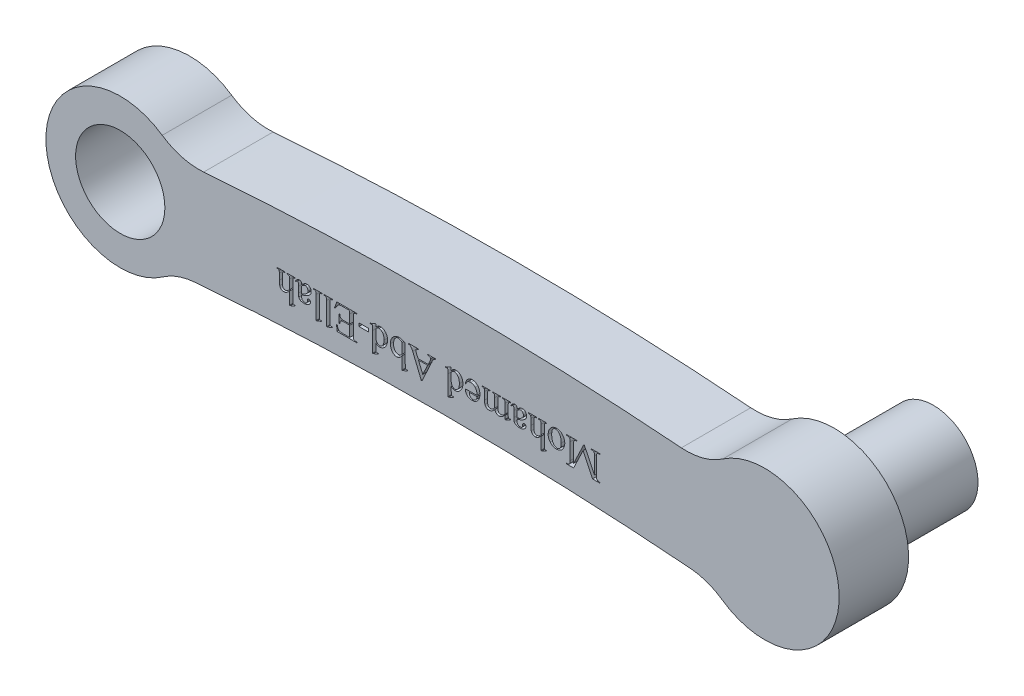
from build123d import *

# Parameters (mm, degrees)
SKETCH1_R           = 45
BOSS_EXTRUDE1_DEPTH = 70
BOSS_EXTRUDE2_START = 100
SKETCH2_R           = 45
BOSS_EXTRUDE2_DEPTH = 100
SKETCH2_2_R         = 45
BOSS_EXTRUDE3_DEPTH = 70
SKETCH3_W           = 9.631195068
SKETCH3_H           = 3.210398356
CUT_EXTRUDE1_DEPTH  = 10


with BuildPart() as part:
    # Sketch1 → Boss-Extrude1 (new body)
    with BuildSketch(Plane.XY):
        with BuildLine():
            ThreePointArc((0, -50), (16.813582449, -53.62278956), (32.095096582, -61.515601783))
            ThreePointArc((32.095096582, -61.515601783), (149.99920109, -0.346173143), (32.664786618, 61.90904383))
            ThreePointArc((32.664786618, 61.90904383), (12.707688902, 52.742106359), (-9.160818861, 50.720507964))
            ThreePointArc((-9.160818861, 50.720507964), (-249.999999231, 60), (-490.839179606, 50.720508082))
            ThreePointArc((-490.839179606, 50.720508082), (-512.707688159, 52.74210616), (-532.664786618, 61.90904383))
            ThreePointArc((-532.664786618, 61.90904383), (-649.99920109, -0.346173143), (-532.095096582, -61.515601783))
            ThreePointArc((-532.095096582, -61.515601783), (-516.813582449, -53.62278956), (-500, -50))
            ThreePointArc((-500, -50), (-250, -40), (0, -50))
        make_face()
        with Locations((75, 0)):
            Circle(SKETCH1_R, mode=Mode.SUBTRACT)
        with Locations((-575, 0)):
            Circle(SKETCH1_R, mode=Mode.SUBTRACT)
    extrude(amount=BOSS_EXTRUDE1_DEPTH)



with BuildPart() as body_2:
    # Sketch2 → Boss-Extrude2 (new body)
    with BuildSketch(Plane(origin=(0, 0, 0), x_dir=(-1, 0, 0), z_dir=(0, 0, -1)).offset(BOSS_EXTRUDE2_START)):
        with Locations(Location((-75, 0, 0), (0, 0, 180))):
            Circle(SKETCH2_R)
    extrude(amount=-BOSS_EXTRUDE2_DEPTH)


with BuildPart() as part_1:
    add(part.part)

    add(body_2.part)  # Boss-Extrude3 merges body 2
    # Sketch2<2> → Boss-Extrude3 (add)
    with BuildSketch(Plane(origin=(0, 0, 0), x_dir=(-1, 0, 0), z_dir=(0, 0, -1))):
        with Locations(Location((-75, 0, 0), (0, 0, 180))):
            Circle(SKETCH2_2_R)
    extrude(amount=-BOSS_EXTRUDE3_DEPTH)

    # Sketch3 → Cut-Extrude1 (cut)
    # profile 1 of 16: a face of its own
    with BuildSketch(Plane.XY.offset(70)):
        with BuildLine():
            Line((-107.094533732, 4.464320122), (-96.749916807, -17.144559091))
            Line((-96.749916807, -17.144559091), (-96.749916807, -0.172921948))
            add(Edge.make_bspline(
                [(-96.749916807, -0.172921948), (-96.749752327, 0.024061727), (-96.749440238, 0.397823856), (-96.78010056, 0.929310692), (-96.818746841, 1.403226014), (-96.86366339, 1.821180446), (-96.936117849, 2.181022533), (-97.024681931, 2.480584658), (-97.119649722, 2.728770637), (-97.210218783, 2.86038202), (-97.25154155, 2.920430635)],
                knots=[0, 0, 0, 0, 1.489562092, 2.826335232, 4.024785645, 5.086235066, 6.003918599, 6.795325823, 7.450358981, 8, 8, 8, 8], degree=3))
            add(Edge.make_bspline(
                [(-97.25154155, 2.920430635), (-97.375478006, 3.049073519), (-97.629997676, 3.313258456), (-98.147357067, 3.569643716), (-98.754098416, 3.729556536), (-99.191790673, 3.743474594), (-99.425248771, 3.750898265)],
                knots=[0, 0, 0, 0, 0.886270022, 1.820071046, 2.837260518, 4, 4, 4, 4], degree=3))
            Line((-99.425248771, 3.750898265), (-100.317026092, 3.750898265))
            Line((-100.317026092, 3.750898265), (-100.317026092, 4.464320122))
            Line((-100.317026092, 4.464320122), (-91.39925288, 4.464320122))
            Line((-91.39925288, 4.464320122), (-91.39925288, 3.750898265))
            Line((-91.39925288, 3.750898265), (-92.291030201, 3.750898265))
            add(Edge.make_bspline(
                [(-92.291030201, 3.750898265), (-92.419441, 3.748095118), (-92.668015859, 3.742668847), (-93.025774512, 3.689510797), (-93.356295699, 3.615722609), (-93.657047133, 3.500906287), (-93.930883068, 3.358276428), (-94.174029187, 3.17813778), (-94.382218918, 2.961978277), (-94.499972196, 2.801096125), (-94.559488762, 2.719780738)],
                knots=[0, 0, 0, 0, 1.182386838, 2.288838982, 3.326958154, 4.296765023, 5.246416275, 6.164047556, 7.072046332, 8, 8, 8, 8], degree=3))
            add(Edge.make_bspline(
                [(-94.559488762, 2.719780738), (-94.592710796, 2.65923497), (-94.665846256, 2.525948655), (-94.746782455, 2.288981656), (-94.809898214, 2.000379299), (-94.872445923, 1.664456613), (-94.916255979, 1.275263196), (-94.939057375, 0.837899225), (-94.965949533, 0.349439916), (-94.96621977, 0.007339148), (-94.966362165, -0.172921948)],
                knots=[0, 0, 0, 0, 0.561580455, 1.236271222, 2.028879402, 2.966584022, 4.017422664, 5.2149421, 6.532486222, 8, 8, 8, 8], degree=3))
            Line((-94.966362165, -0.172921948), (-94.966362165, -16.581624657))
            add(Edge.make_bspline(
                [(-94.966362165, -16.581624657), (-94.96371823, -16.858755677), (-94.958827427, -17.371398293), (-94.883804155, -18.078733949), (-94.781913085, -18.668729505), (-94.651418641, -19.005630877), (-94.592930412, -19.156631672)],
                knots=[0, 0, 0, 0, 1.269138846, 2.34767893, 3.259421848, 4, 4, 4, 4], degree=3))
            add(Edge.make_bspline(
                [(-94.592930412, -19.156631672), (-94.544052619, -19.249674986), (-94.443499663, -19.441086667), (-94.227595625, -19.69613987), (-93.958831289, -19.928620684), (-93.630601905, -20.140071129), (-93.214553763, -20.309281465), (-92.701633682, -20.426678898), (-92.084860932, -20.496428017), (-91.639124013, -20.502290177), (-91.39925288, -20.50544487)],
                knots=[0, 0, 0, 0, 0.685402419, 1.410031758, 2.167502244, 3.003026701, 3.950322296, 5.087339078, 6.432565839, 8, 8, 8, 8], degree=3))
            Line((-91.39925288, -20.50544487), (-91.39925288, -21.218866727))
            Line((-91.39925288, -21.218866727), (-98.717400522, -21.218866727))
            Line((-98.717400522, -21.218866727), (-108.259417858, -1.259775558))
            Line((-108.259417858, -1.259775558), (-117.829303236, -21.218866727))
            Line((-117.829303236, -21.218866727), (-124.930080155, -21.218866727))
            Line((-124.930080155, -21.218866727), (-124.930080155, -20.50544487))
            Line((-124.930080155, -20.50544487), (-124.055023659, -20.50544487))
            add(Edge.make_bspline(
                [(-124.055023659, -20.50544487), (-123.924749158, -20.502744089), (-123.674304911, -20.497552014), (-123.312916299, -20.443563526), (-122.97894586, -20.369828895), (-122.674751835, -20.258197977), (-122.402862436, -20.111252344), (-122.160766402, -19.931085523), (-121.946981794, -19.718445981), (-121.82905879, -19.55593268), (-121.769844274, -19.474327342)],
                knots=[0, 0, 0, 0, 1.192523296, 2.292548393, 3.341205387, 4.321321698, 5.250455988, 6.162757026, 7.077436536, 8, 8, 8, 8], degree=3))
            add(Edge.make_bspline(
                [(-121.769844274, -19.474327342), (-121.736622239, -19.413781575), (-121.66348678, -19.28049526), (-121.58255058, -19.043528261), (-121.519434821, -18.754925904), (-121.456887112, -18.419003218), (-121.413077057, -18.029809801), (-121.390275661, -17.59244583), (-121.363383503, -17.103986521), (-121.363113265, -16.761885753), (-121.362970871, -16.581624657)],
                knots=[0, 0, 0, 0, 0.561580455, 1.236271222, 2.028879402, 2.966584022, 4.017422664, 5.2149421, 6.532486222, 8, 8, 8, 8], degree=3))
            Line((-121.362970871, -16.581624657), (-121.362970871, -0.172921948))
            add(Edge.make_bspline(
                [(-121.362970871, -0.172921948), (-121.362733563, 0.024070477), (-121.362283289, 0.397849209), (-121.393866956, 0.929225105), (-121.429559122, 1.403730308), (-121.483759877, 1.820804928), (-121.554937573, 2.180861059), (-121.641945065, 2.481893661), (-121.74390274, 2.729338661), (-121.838176613, 2.860438985), (-121.881316439, 2.920430635)],
                knots=[0, 0, 0, 0, 1.486776415, 2.821049613, 4.017258766, 5.078485589, 5.994452933, 6.784380121, 7.443731031, 8, 8, 8, 8], degree=3))
            add(Edge.make_bspline(
                [(-121.881316439, 2.920430635), (-122.007373191, 3.048691917), (-122.2640762, 3.309884247), (-122.779500199, 3.572500534), (-123.38623235, 3.72797732), (-123.823577441, 3.742966096), (-124.055023659, 3.750898265)],
                knots=[0, 0, 0, 0, 0.893460505, 1.819450328, 2.846037184, 4, 4, 4, 4], degree=3))
            Line((-124.055023659, 3.750898265), (-124.930080155, 3.750898265))
            Line((-124.930080155, 3.750898265), (-124.930080155, 4.464320122))
            Line((-124.930080155, 4.464320122), (-114.228752302, 4.464320122))
            Line((-114.228752302, 4.464320122), (-114.228752302, 3.750898265))
            Line((-114.228752302, 3.750898265), (-115.120529623, 3.750898265))
            add(Edge.make_bspline(
                [(-115.120529623, 3.750898265), (-115.250791634, 3.748145735), (-115.501211869, 3.742854174), (-115.860974479, 3.689821192), (-116.192637159, 3.614279212), (-116.495310666, 3.503806596), (-116.766893637, 3.356450002), (-117.008961049, 3.178176274), (-117.217446613, 2.96345989), (-117.33160688, 2.801292335), (-117.388988183, 2.719780738)],
                knots=[0, 0, 0, 0, 1.198333024, 2.303717216, 3.340834392, 4.325725627, 5.259386468, 6.176132048, 7.08325442, 8, 8, 8, 8], degree=3))
            add(Edge.make_bspline(
                [(-117.388988183, 2.719780738), (-117.422210218, 2.65923497), (-117.495345677, 2.525948655), (-117.576281877, 2.288981656), (-117.639397636, 2.000379299), (-117.701945345, 1.664456613), (-117.7457554, 1.275263196), (-117.768556796, 0.837899225), (-117.795448954, 0.349439916), (-117.795719192, 0.007339148), (-117.795861586, -0.172921948)],
                knots=[0, 0, 0, 0, 0.561580455, 1.236271222, 2.028879402, 2.966584022, 4.017422664, 5.2149421, 6.532486222, 8, 8, 8, 8], degree=3))
            Line((-117.795861586, -0.172921948), (-117.795861586, -17.144559091))
            Line((-117.795861586, -17.144559091), (-107.451244661, 4.464320122))
            Line((-107.451244661, 4.464320122), (-107.094533732, 4.464320122))
        make_face()
    # profile 2 of 16: a face of its own
    with BuildSketch(Plane.XY.offset(70)):
        with BuildLine():
            add(Edge.make_bspline(
                [(-135.113062441, -13.371226301), (-135.434998327, -13.363467003), (-136.065318003, -13.34827504), (-136.98527177, -13.205504542), (-137.854551787, -12.971574715), (-138.674682682, -12.644691579), (-139.451859217, -12.232851438), (-140.1711737, -11.71326169), (-140.847583148, -11.108913342), (-141.247074603, -10.646713887), (-141.45025503, -10.411640316)],
                knots=[0, 0, 0, 0, 1.065475926, 2.086099963, 3.0740863, 4.040596107, 5.003967888, 5.978764027, 6.972004072, 8, 8, 8, 8], degree=3))
            add(Edge.make_bspline(
                [(-141.45025503, -10.411640316), (-141.611638688, -10.198557839), (-141.930279844, -9.777840851), (-142.34463521, -9.108692187), (-142.699324917, -8.416724933), (-142.980243426, -7.696192787), (-143.207684624, -6.957502873), (-143.361478494, -6.193778982), (-143.459209988, -5.407219648), (-143.472388151, -4.873622284), (-143.479048435, -4.603940512)],
                knots=[0, 0, 0, 0, 1.022034223, 2.017937682, 3.006408923, 3.992245156, 4.972481023, 5.959290214, 6.968618909, 8, 8, 8, 8], degree=3))
            add(Edge.make_bspline(
                [(-143.479048435, -4.603940512), (-143.464018309, -4.21665356), (-143.433751839, -3.436765978), (-143.21872516, -2.265190674), (-142.863111276, -1.09148497), (-142.459535004, -0.122863944), (-142.072761326, 0.631530565), (-141.753738032, 1.170237418), (-141.409443679, 1.672840801), (-141.035017915, 2.135260871), (-140.637100979, 2.562564698), (-140.211961576, 2.953383125), (-139.761020118, 3.311993838), (-139.123376829, 3.731067948), (-138.281270713, 4.171392903), (-137.204961759, 4.543904458), (-136.074917822, 4.784352246), (-135.30008083, 4.808682876), (-134.906838936, 4.821031051)],
                knots=[0, 0, 0, 0, 1.308870312, 2.635698662, 4.012652074, 5.448446227, 6.175942206, 6.877127573, 7.5635028, 8.233417747, 8.886608635, 9.535528375, 10.183870419, 10.831847337, 12.112754659, 13.383971639, 14.672324686, 16, 16, 16, 16], degree=3))
            add(Edge.make_bspline(
                [(-134.906838936, 4.821031051), (-134.586666796, 4.811634635), (-133.961495323, 4.793287096), (-133.0495391, 4.642609569), (-132.186374078, 4.407810131), (-131.376340197, 4.060649683), (-130.613943909, 3.62674379), (-129.905754375, 3.087753004), (-129.242746301, 2.459229813), (-128.859344839, 1.974266508), (-128.664397688, 1.727678468)],
                knots=[0, 0, 0, 0, 1.060271855, 2.070297928, 3.05457633, 4.017288914, 4.982419316, 5.953831287, 6.959589877, 8, 8, 8, 8], degree=3))
            add(Edge.make_bspline(
                [(-128.664397688, 1.727678468), (-128.508466752, 1.508961288), (-128.200230798, 1.076612837), (-127.804823301, 0.393164739), (-127.468854628, -0.307932017), (-127.186676344, -1.0271477), (-126.975331815, -1.772492362), (-126.828020267, -2.537276589), (-126.726269792, -3.319287387), (-126.717866762, -3.847461872), (-126.713634798, -4.113462986)],
                knots=[0, 0, 0, 0, 1.027900205, 2.031898275, 3.018102564, 4.002149979, 4.98599173, 5.979173514, 6.982264175, 8, 8, 8, 8], degree=3))
            add(Edge.make_bspline(
                [(-126.713634798, -4.113462986), (-126.727325666, -4.508353081), (-126.754859511, -5.302520591), (-126.989041516, -6.487713482), (-127.367770289, -7.66540407), (-127.794174449, -8.627263356), (-128.197887451, -9.371802324), (-128.528330133, -9.899261559), (-128.882118674, -10.388856768), (-129.265496423, -10.836654041), (-129.665019282, -11.251128229), (-130.092308425, -11.624397546), (-130.536134439, -11.969203223), (-131.166285142, -12.354754651), (-131.980835201, -12.7581982), (-132.997424441, -13.116100285), (-134.047299426, -13.326546363), (-134.757302262, -13.356311782), (-135.113062441, -13.371226301)],
                knots=[0, 0, 0, 0, 1.363475223, 2.742098965, 4.157128083, 5.631487987, 6.369750225, 7.082191163, 7.780700551, 8.454710021, 9.117498573, 9.767891594, 10.413706565, 11.056739837, 12.317058655, 13.54734686, 14.771052344, 16, 16, 16, 16], degree=3))
        make_face()
        with BuildLine():
            add(Edge.make_bspline(
                [(-134.533407182, -12.301093515), (-134.365617137, -12.29309642), (-134.02827553, -12.277018273), (-133.522904894, -12.159496688), (-133.021434497, -11.965601714), (-132.513582259, -11.707894025), (-132.029814636, -11.341481946), (-131.591646607, -10.860479089), (-131.213218047, -10.261347762), (-130.879764174, -9.556889977), (-130.606597011, -8.738364168), (-130.4176488, -7.808491713), (-130.300315477, -6.773215199), (-130.287464683, -6.047846763), (-130.280744082, -5.668499689)],
                knots=[0, 0, 0, 0, 0.685170062, 1.377533269, 2.107760278, 2.878405499, 3.696621504, 4.572248075, 5.521736151, 6.58098037, 7.749876973, 9.037530908, 10.450712872, 12, 12, 12, 12], degree=3))
            add(Edge.make_bspline(
                [(-130.280744082, -5.668499689), (-130.284309463, -5.352505652), (-130.291303321, -4.732651121), (-130.36759327, -3.819272611), (-130.483412249, -2.939239036), (-130.641841184, -2.091083743), (-130.857582655, -1.278951043), (-131.110604899, -0.496858333), (-131.419845303, 0.250305739), (-131.764861309, 0.958864568), (-132.150835733, 1.607237089), (-132.567154635, 2.17983581), (-133.014360261, 2.664995221), (-133.493657081, 3.061745091), (-134.004700795, 3.374143205), (-134.54947047, 3.59143026), (-135.1233473, 3.725428557), (-135.515489107, 3.742309292), (-135.715012133, 3.750898265)],
                knots=[0, 0, 0, 0, 1.268566528, 2.488422621, 3.677482539, 4.831869894, 5.950112441, 7.049457571, 8.130038334, 9.194324352, 10.211444258, 11.155934237, 12.032169512, 12.853626851, 13.646855938, 14.426783415, 15.199542289, 16, 16, 16, 16], degree=3))
            add(Edge.make_bspline(
                [(-135.715012133, 3.750898265), (-135.863927429, 3.747091223), (-136.158020735, 3.739572682), (-136.588904078, 3.665582136), (-136.997899966, 3.541691608), (-137.388028422, 3.37325351), (-137.755699351, 3.154454755), (-138.105275841, 2.88898864), (-138.434807682, 2.575500832), (-138.742927938, 2.21058376), (-139.027375869, 1.788376297), (-139.264079583, 1.293473627), (-139.462273516, 0.73194218), (-139.630677508, 0.104361236), (-139.754012791, -0.593475307), (-139.849120267, -1.357900331), (-139.904473997, -2.191607233), (-139.909384047, -2.770140022), (-139.911939151, -3.071198242)],
                knots=[0, 0, 0, 0, 0.792356549, 1.564827549, 2.31903121, 3.063308986, 3.821653099, 4.591268609, 5.395940891, 6.238222809, 7.129884604, 8.098755023, 9.150113489, 10.297085252, 11.554355138, 12.919966544, 14.397205131, 16, 16, 16, 16], degree=3))
            add(Edge.make_bspline(
                [(-139.911939151, -3.071198242), (-139.904767778, -3.452212716), (-139.890789712, -4.194866343), (-139.804183846, -5.277101857), (-139.648276228, -6.295829234), (-139.429912792, -7.250645309), (-139.161168104, -8.14841484), (-138.817774996, -8.980526242), (-138.422156263, -9.756208067), (-138.098292461, -10.225323507), (-137.938881828, -10.456229182)],
                knots=[0, 0, 0, 0, 1.176846895, 2.29384885, 3.35049909, 4.356938079, 5.31714966, 6.241027227, 7.134207148, 8, 8, 8, 8], degree=3))
            add(Edge.make_bspline(
                [(-137.938881828, -10.456229182), (-137.826968152, -10.603936807), (-137.609421092, -10.891063106), (-137.236066053, -11.26557885), (-136.846025904, -11.589784672), (-136.424655435, -11.844134663), (-135.984765801, -12.050486014), (-135.521182833, -12.192360334), (-135.035211187, -12.287837504), (-134.702945654, -12.296614867), (-134.533407182, -12.301093515)],
                knots=[0, 0, 0, 0, 1.101841247, 2.141850159, 3.140102416, 4.113043798, 5.063027868, 6.02484522, 6.992177371, 8, 8, 8, 8], degree=3))
        make_face(mode=Mode.SUBTRACT)
    # profile 3 of 16: a face of its own
    with BuildSketch(Plane.XY.offset(70)):
        with BuildLine():
            Line((-150.613267004, -22.288999512), (-150.613267004, -9.893294748))
            add(Edge.make_bspline(
                [(-150.613267004, -9.893294748), (-150.785937288, -10.069888323), (-151.118410388, -10.409915639), (-151.599721698, -10.898792804), (-152.063791476, -11.32689164), (-152.499570714, -11.706911676), (-152.904797736, -12.041902335), (-153.281500723, -12.328735782), (-153.635743619, -12.55775866), (-154.059734856, -12.802167194), (-154.580576279, -13.027166224), (-155.203688722, -13.22611341), (-155.829149011, -13.347750502), (-156.247680846, -13.363464569), (-156.454408458, -13.371226301)],
                knots=[0, 0, 0, 0, 1.269190966, 2.443801245, 3.524661831, 4.51256352, 5.414676556, 6.226157774, 6.943759989, 7.58082814, 8.739186543, 9.850317078, 10.938195903, 12, 12, 12, 12], degree=3))
            add(Edge.make_bspline(
                [(-156.454408458, -13.371226301), (-156.695092878, -13.362961035), (-157.163314193, -13.346882), (-157.835702793, -13.181852712), (-158.460071142, -12.931940835), (-159.028398234, -12.571478849), (-159.537245751, -12.098546781), (-159.961819699, -11.502860095), (-160.332664359, -10.801069565), (-160.504975105, -10.279223915), (-160.595599393, -10.004766913)],
                knots=[0, 0, 0, 0, 0.997393848, 1.940304486, 2.856982476, 3.779224768, 4.717867031, 5.722155937, 6.802001604, 8, 8, 8, 8], degree=3))
            add(Edge.make_bspline(
                [(-160.595599393, -10.004766913), (-160.62506895, -9.893647081), (-160.688932038, -9.652840763), (-160.755768672, -9.255102399), (-160.826607511, -8.796972928), (-160.871788704, -8.275577147), (-160.911721264, -7.692161959), (-160.938299005, -7.045380783), (-160.954998628, -6.335565857), (-160.956898434, -5.84129247), (-160.95788393, -5.584895566)],
                knots=[0, 0, 0, 0, 0.62023975, 1.34411335, 2.175224329, 3.122231482, 4.167574304, 5.331981634, 6.616005499, 8, 8, 8, 8], degree=3))
            Line((-160.95788393, -5.584895566), (-160.95788393, 0.540499909))
            add(Edge.make_bspline(
                [(-160.95788393, 0.540499909), (-160.961217768, 0.791402999), (-160.96732382, 1.250941555), (-161.0063098, 1.875107283), (-161.081831347, 2.374129246), (-161.174069246, 2.653678841), (-161.214269909, 2.77551682)],
                knots=[0, 0, 0, 0, 1.331848257, 2.439330754, 3.319803028, 4, 4, 4, 4], degree=3))
            add(Edge.make_bspline(
                [(-161.214269909, 2.77551682), (-161.286626778, 2.918212273), (-161.433228146, 3.207325789), (-161.775018301, 3.470653568), (-162.125343814, 3.625531226), (-162.491929388, 3.693246491), (-162.942410351, 3.744332426), (-163.274406843, 3.748586178), (-163.454860429, 3.750898265)],
                knots=[0, 0, 0, 0, 1.090090228, 2.208618504, 2.878681772, 3.71654763, 4.758850833, 6, 6, 6, 6], degree=3))
            Line((-163.454860429, 3.750898265), (-163.454860429, 4.464320122))
            Line((-163.454860429, 4.464320122), (-155.250509074, 4.464320122))
            Line((-155.250509074, 4.464320122), (-155.250509074, 3.750898265))
            Line((-155.250509074, 3.750898265), (-155.607220003, 3.750898265))
            add(Edge.make_bspline(
                [(-155.607220003, 3.750898265), (-155.772811174, 3.747167606), (-156.079577821, 3.740256358), (-156.501065758, 3.677904037), (-156.844824751, 3.565458675), (-157.108887011, 3.395571474), (-157.313760214, 3.183752127), (-157.471607424, 2.928200544), (-157.610036278, 2.635800125), (-157.667371533, 2.420043559), (-157.697323099, 2.307333727)],
                knots=[0, 0, 0, 0, 1.409076992, 2.610391724, 3.615819684, 4.462549059, 5.256681534, 6.103410908, 7.009234141, 8, 8, 8, 8], degree=3))
            add(Edge.make_bspline(
                [(-157.697323099, 2.307333727), (-157.705460358, 2.233075338), (-157.726971254, 2.036772799), (-157.739562539, 1.66644966), (-157.74170031, 1.151761003), (-157.745410629, 0.759735054), (-157.747485573, 0.540499909)],
                knots=[0, 0, 0, 0, 0.506805967, 1.339744907, 2.512288763, 4, 4, 4, 4], degree=3))
            Line((-157.747485573, 0.540499909), (-157.747485573, -5.662926081))
            add(Edge.make_bspline(
                [(-157.747485573, -5.662926081), (-157.745964451, -5.891445042), (-157.743058067, -6.328072604), (-157.733599359, -6.954327033), (-157.711791931, -7.519284496), (-157.67993727, -8.023157862), (-157.633920512, -8.463322408), (-157.587381132, -8.843460014), (-157.525895512, -9.161386654), (-157.441322615, -9.497459028), (-157.29801066, -9.852389322), (-157.08170084, -10.219180283), (-156.825811997, -10.53703796), (-156.52377683, -10.794724352), (-156.178138901, -10.990885988), (-155.801486836, -11.129873917), (-155.3919232, -11.216856663), (-155.107908065, -11.226145579), (-154.960681445, -11.23096073)],
                knots=[0, 0, 0, 0, 1.543736231, 2.949592391, 4.230705552, 5.362738593, 6.359281905, 7.220143725, 7.948709194, 8.545342993, 9.559123395, 10.521248348, 11.413113761, 12.303388292, 13.186022366, 14.083521411, 15.006543562, 16, 16, 16, 16], degree=3))
            add(Edge.make_bspline(
                [(-154.960681445, -11.23096073), (-154.804280611, -11.22332783), (-154.485421373, -11.2077664), (-154.001572648, -11.11644384), (-153.511351835, -10.956930551), (-152.999454202, -10.734802002), (-152.457923715, -10.412999346), (-151.882152369, -9.965955382), (-151.25506392, -9.39701809), (-150.83712527, -8.961620388), (-150.613267004, -8.728410623)],
                knots=[0, 0, 0, 0, 0.72687996, 1.481912751, 2.27899278, 3.117699901, 4.069537764, 5.196812196, 6.498543363, 8, 8, 8, 8], degree=3))
            Line((-150.613267004, -8.728410623), (-150.613267004, 0.540499909))
            add(Edge.make_bspline(
                [(-150.613267004, 0.540499909), (-150.614772569, 0.808058653), (-150.617461133, 1.285852175), (-150.64913324, 1.920483768), (-150.696236551, 2.387101342), (-150.771611702, 2.717940592), (-150.895067949, 2.948648725), (-151.036504188, 3.145795076), (-151.230437946, 3.312743375), (-151.455245428, 3.47661522), (-151.751408279, 3.607375463), (-152.129171542, 3.690160383), (-152.590286562, 3.744992938), (-152.927972862, 3.748828156), (-153.110243504, 3.750898265)],
                knots=[0, 0, 0, 0, 1.962250361, 3.504092224, 4.65670972, 5.403626609, 5.970352551, 6.564427309, 7.172096802, 7.837374809, 8.599668298, 9.52499414, 10.664082888, 12, 12, 12, 12], degree=3))
            Line((-153.110243504, 3.750898265), (-153.110243504, 4.464320122))
            Line((-153.110243504, 4.464320122), (-144.905892149, 4.464320122))
            Line((-144.905892149, 4.464320122), (-144.905892149, 3.750898265))
            add(Edge.make_bspline(
                [(-144.905892149, 3.750898265), (-145.077122832, 3.747226405), (-145.402452155, 3.740250063), (-145.861990885, 3.672190421), (-146.268948424, 3.568399009), (-146.505199274, 3.450143972), (-146.616989884, 3.394187337)],
                knots=[0, 0, 0, 0, 1.162692379, 2.20905458, 3.152549584, 4, 4, 4, 4], degree=3))
            add(Edge.make_bspline(
                [(-146.616989884, 3.394187337), (-146.674102929, 3.357012852), (-146.792974078, 3.279640447), (-146.95127194, 3.120843504), (-147.08195183, 2.91507154), (-147.20963064, 2.66115491), (-147.305201292, 2.311010692), (-147.35275136, 1.840143917), (-147.403060261, 1.236349373), (-147.402936737, 0.787766866), (-147.402868648, 0.540499909)],
                knots=[0, 0, 0, 0, 0.528073095, 1.099094886, 1.723020154, 2.413096901, 3.298518939, 4.520181108, 6.081859607, 8, 8, 8, 8], degree=3))
            Line((-147.402868648, 0.540499909), (-147.402868648, -15.154780943))
            add(Edge.make_bspline(
                [(-147.402868648, -15.154780943), (-147.403307751, -15.377726335), (-147.404142065, -15.801331182), (-147.398569269, -16.403314697), (-147.388232837, -16.938440802), (-147.37110117, -17.404745866), (-147.352698407, -17.804059299), (-147.341831136, -18.135523496), (-147.311640517, -18.399084311), (-147.277580453, -18.651211264), (-147.223522965, -18.899882802), (-147.133327407, -19.145287949), (-147.036107822, -19.346224518), (-146.879667287, -19.544108136), (-146.60732564, -19.705489152), (-146.364825639, -19.725710191), (-146.237984522, -19.73628693)],
                knots=[0, 0, 0, 0, 1.815067768, 3.448698783, 4.901068079, 6.172425557, 7.247298888, 8.155966481, 8.870879462, 9.405648931, 10.227594999, 10.935755784, 11.531057737, 12.036577554, 12.973019822, 14, 14, 14, 14], degree=3))
            add(Edge.make_bspline(
                [(-146.237984522, -19.73628693), (-146.170731505, -19.733033326), (-146.017235979, -19.725607433), (-145.768613828, -19.652087201), (-145.463931014, -19.569094501), (-145.250626413, -19.482494827), (-145.134410088, -19.435312085)],
                knots=[0, 0, 0, 0, 0.700816445, 1.599514677, 2.692125801, 4, 4, 4, 4], degree=3))
            Line((-145.134410088, -19.435312085), (-144.905892149, -20.148733941))
            Line((-144.905892149, -20.148733941), (-149.793946591, -22.288999512))
            Line((-149.793946591, -22.288999512), (-150.613267004, -22.288999512))
        make_face()
    # profile 4 of 16: a face of its own
    with BuildSketch(Plane.XY.offset(70)):
        with BuildLine():
            add(Edge.make_bspline(
                [(-174.869610139, 1.984064448), (-174.65832603, 2.146381135), (-174.257570386, 2.454257238), (-173.6815939, 2.880278804), (-173.175761322, 3.26436483), (-172.725332698, 3.584019608), (-172.338626011, 3.855916573), (-172.012652129, 4.070159305), (-171.751691742, 4.237430187), (-171.592846364, 4.318463815), (-171.525445185, 4.352847957)],
                knots=[0, 0, 0, 0, 1.558875, 2.95681467, 4.191698034, 5.274657479, 6.188356203, 6.95716577, 7.557505181, 8, 8, 8, 8], degree=3))
            add(Edge.make_bspline(
                [(-171.525445185, 4.352847957), (-171.354214667, 4.426029425), (-171.012833852, 4.571930691), (-170.47387417, 4.711138552), (-169.92187495, 4.807595153), (-169.547250751, 4.816510737), (-169.357311573, 4.821031051)],
                knots=[0, 0, 0, 0, 0.998482016, 1.990665029, 2.981241918, 4, 4, 4, 4], degree=3))
            add(Edge.make_bspline(
                [(-169.357311573, 4.821031051), (-169.210436761, 4.815803305), (-168.92306982, 4.805574995), (-168.501444545, 4.753220177), (-168.102557122, 4.646456474), (-167.717212695, 4.51975482), (-167.357542594, 4.334902254), (-167.015953152, 4.118920688), (-166.696730271, 3.858406116), (-166.396717705, 3.564941512), (-166.12505002, 3.238604756), (-165.890247688, 2.884155079), (-165.687566784, 2.507780362), (-165.519320485, 2.105219511), (-165.391727611, 1.675235924), (-165.304977612, 1.221353008), (-165.245669783, 0.744572125), (-165.240873937, 0.418071552), (-165.238415071, 0.25067228)],
                knots=[0, 0, 0, 0, 1.021513656, 1.998635777, 2.944537382, 3.887967423, 4.812018718, 5.747014406, 6.692916011, 7.670038131, 8.660467728, 9.638272315, 10.62050138, 11.627794116, 12.665585642, 13.731832456, 14.837093629, 16, 16, 16, 16], degree=3))
            add(Edge.make_bspline(
                [(-165.238415071, 0.25067228), (-165.243686708, 0.040155963), (-165.253883482, -0.367039628), (-165.365893366, -0.956495438), (-165.536335038, -1.506907633), (-165.717729527, -1.838176872), (-165.806923113, -2.001065456)],
                knots=[0, 0, 0, 0, 1.073355964, 2.076161235, 3.054028157, 4, 4, 4, 4], degree=3))
            add(Edge.make_bspline(
                [(-165.806923113, -2.001065456), (-165.95280696, -2.221641617), (-166.259212976, -2.684927063), (-166.87885697, -3.311460043), (-167.629357818, -3.923120369), (-168.360096895, -4.409560376), (-169.039536611, -4.79101624), (-169.634587019, -5.111890286), (-170.315040824, -5.434864552), (-171.070063517, -5.783099333), (-171.905378106, -6.14599036), (-172.825510031, -6.513068623), (-173.817468982, -6.915051448), (-174.510361564, -7.173263576), (-174.869610139, -7.307140517)],
                knots=[0, 0, 0, 0, 0.890298884, 1.869932423, 2.956460214, 4.154090565, 4.824947103, 5.584755991, 6.434074746, 7.365110963, 8.389663198, 9.50575716, 10.706793506, 12, 12, 12, 12], degree=3))
            Line((-174.869610139, -7.307140517), (-174.869610139, -7.959252683))
            add(Edge.make_bspline(
                [(-174.869610139, -7.959252683), (-174.868208529, -8.158129371), (-174.865507091, -8.541440645), (-174.824492088, -9.091888522), (-174.766577399, -9.595045361), (-174.678681493, -10.048352397), (-174.562209568, -10.451190066), (-174.422132824, -10.805637244), (-174.263883959, -11.116677229), (-174.009119828, -11.457794311), (-173.623136732, -11.807726941), (-173.057178016, -12.090538207), (-172.408552386, -12.277870293), (-171.943062027, -12.293088934), (-171.698227041, -12.301093515)],
                knots=[0, 0, 0, 0, 1.155955884, 2.227968126, 3.207331715, 4.09915391, 4.909261858, 5.641373183, 6.31297607, 6.930833505, 8.108636236, 9.301938656, 10.580894753, 12, 12, 12, 12], degree=3))
            add(Edge.make_bspline(
                [(-171.698227041, -12.301093515), (-171.511519001, -12.295119272), (-171.154057131, -12.283681284), (-170.649609283, -12.15478165), (-170.197583477, -11.960808718), (-169.951693406, -11.759086488), (-169.831068275, -11.660128566)],
                knots=[0, 0, 0, 0, 1.106638015, 2.118713769, 3.077106298, 4, 4, 4, 4], degree=3))
            add(Edge.make_bspline(
                [(-169.831068275, -11.660128566), (-169.721413432, -11.555072048), (-169.510728795, -11.353222376), (-169.294593935, -10.985997957), (-169.14701949, -10.602875849), (-169.13119997, -10.334979765), (-169.123220026, -10.199843202)],
                knots=[0, 0, 0, 0, 1.0849483, 2.084558522, 3.033781409, 4, 4, 4, 4], degree=3))
            Line((-169.123220026, -10.199843202), (-169.162235284, -9.107415984))
            add(Edge.make_bspline(
                [(-169.162235284, -9.107415984), (-169.157647866, -8.971249685), (-169.148939271, -8.712756313), (-169.06310806, -8.348581827), (-168.927028097, -8.030113245), (-168.725110659, -7.769884433), (-168.484785608, -7.558183343), (-168.199803583, -7.415238415), (-167.884600174, -7.319117494), (-167.661850898, -7.311240984), (-167.54588889, -7.307140517)],
                knots=[0, 0, 0, 0, 1.193171844, 2.265075979, 3.265111623, 4.207656529, 5.132688692, 6.05166446, 6.985707585, 8, 8, 8, 8], degree=3))
            add(Edge.make_bspline(
                [(-167.54588889, -7.307140517), (-167.43365503, -7.311247249), (-167.2141097, -7.319280598), (-166.90473577, -7.418383805), (-166.627306487, -7.573344756), (-166.388223955, -7.786390983), (-166.190152232, -8.05062385), (-166.050416047, -8.364750804), (-165.965686587, -8.722123362), (-165.956596466, -8.975007323), (-165.951836928, -9.107415984)],
                knots=[0, 0, 0, 0, 0.992742159, 1.941944306, 2.85001292, 3.796202858, 4.762437503, 5.758597029, 6.826413641, 8, 8, 8, 8], degree=3))
            add(Edge.make_bspline(
                [(-165.951836928, -9.107415984), (-165.957426604, -9.239746), (-165.968545495, -9.502974686), (-166.051485742, -9.892128359), (-166.177481271, -10.274321804), (-166.368847901, -10.644781145), (-166.59941787, -11.012061965), (-166.889988622, -11.367002066), (-167.232513273, -11.710403178), (-167.618049794, -12.051362828), (-168.057468178, -12.360641639), (-168.537952135, -12.635310618), (-169.060865225, -12.865299084), (-169.627572037, -13.04741231), (-170.237094253, -13.19159982), (-170.888842276, -13.297265815), (-171.581898402, -13.35765363), (-172.056679293, -13.366625145), (-172.300176733, -13.371226301)],
                knots=[0, 0, 0, 0, 0.751140095, 1.494155489, 2.25171791, 3.030448606, 3.856037921, 4.711441448, 5.629336056, 6.609203153, 7.63113118, 8.675694824, 9.748296603, 10.869631461, 12.052213556, 13.303124852, 14.616873157, 16, 16, 16, 16], degree=3))
            add(Edge.make_bspline(
                [(-172.300176733, -13.371226301), (-172.668641802, -13.362227518), (-173.373362591, -13.345016581), (-174.37876796, -13.198176442), (-175.288087656, -12.965345569), (-175.829555928, -12.708836496), (-176.090230348, -12.585347537)],
                knots=[0, 0, 0, 0, 1.131090562, 2.163306919, 3.115776626, 4, 4, 4, 4], degree=3))
            add(Edge.make_bspline(
                [(-176.090230348, -12.585347537), (-176.269843716, -12.478734005), (-176.626324582, -12.267136814), (-177.077168975, -11.82649688), (-177.463033706, -11.313111392), (-177.646495366, -10.919062561), (-177.740018392, -10.71818877)],
                knots=[0, 0, 0, 0, 0.983465646, 1.951896387, 2.955940722, 4, 4, 4, 4], degree=3))
            add(Edge.make_bspline(
                [(-177.740018392, -10.71818877), (-177.7670162, -10.64048213), (-177.82610923, -10.470397185), (-177.900105122, -10.18241082), (-177.948665236, -9.838130096), (-178.003317933, -9.443112488), (-178.031286076, -8.99237961), (-178.061205173, -8.489084095), (-178.077012376, -7.929620417), (-178.078978711, -7.539380292), (-178.080008496, -7.335008558)],
                knots=[0, 0, 0, 0, 0.578071798, 1.265288381, 2.085304142, 3.019791722, 4.067310373, 5.257317904, 6.563636446, 8, 8, 8, 8], degree=3))
            Line((-178.080008496, -7.335008558), (-178.080008496, -1.354526898))
            add(Edge.make_bspline(
                [(-178.080008496, -1.354526898), (-178.079386868, -1.153873488), (-178.078212653, -0.774851815), (-178.086002719, -0.236093228), (-178.089395529, 0.239585331), (-178.100129684, 0.655834141), (-178.117459635, 1.010640319), (-178.134372782, 1.304129598), (-178.148165292, 1.536945283), (-178.177942909, 1.758337187), (-178.216346108, 1.976497211), (-178.28331165, 2.191704277), (-178.362518, 2.364214361), (-178.496943796, 2.516883143), (-178.690424735, 2.651039999), (-178.867372475, 2.670915496), (-178.955064992, 2.68076548)],
                knots=[0, 0, 0, 0, 1.897012572, 3.583337452, 5.094023655, 6.394303207, 7.519693162, 8.452124687, 9.174212152, 9.723239193, 10.563790437, 11.263747987, 11.852893691, 12.338715684, 13.176693618, 14, 14, 14, 14], degree=3))
            add(Edge.make_bspline(
                [(-178.955064992, 2.68076548), (-179.047718437, 2.677998264), (-179.225605447, 2.672685436), (-179.385601927, 2.595249225), (-179.462263343, 2.558146098)],
                knots=[0, 0, 0, 0, 1.041711203, 2, 2, 2, 2], degree=3))
            add(Edge.make_bspline(
                [(-179.462263343, 2.558146098), (-179.541218659, 2.503615277), (-179.73632256, 2.368865949), (-180.054872303, 2.088462484), (-180.46764626, 1.709809233), (-180.767419479, 1.416572558), (-180.933695923, 1.253921766)],
                knots=[0, 0, 0, 0, 0.584502685, 1.44434548, 2.5824446, 4, 4, 4, 4], degree=3))
            Line((-180.933695923, 1.253921766), (-180.933695923, 2.251597644))
            add(Edge.make_bspline(
                [(-180.933695923, 2.251597644), (-180.761616616, 2.454523679), (-180.43061512, 2.844860102), (-179.912937296, 3.370674276), (-179.398067238, 3.813915203), (-178.891895715, 4.18126229), (-178.38754729, 4.461995827), (-177.891200638, 4.667565663), (-177.397504693, 4.798667179), (-177.066360954, 4.813672737), (-176.903977153, 4.821031051)],
                knots=[0, 0, 0, 0, 1.29495671, 2.490901519, 3.587659578, 4.59909354, 5.530268421, 6.390197302, 7.210596943, 8, 8, 8, 8], degree=3))
            add(Edge.make_bspline(
                [(-176.903977153, 4.821031051), (-176.756155532, 4.814906912), (-176.471571997, 4.803116829), (-176.070517372, 4.673356523), (-175.715087536, 4.470420653), (-175.410882154, 4.175451919), (-175.164567103, 3.781984563), (-175.000246905, 3.277998781), (-174.887328978, 2.668981283), (-174.875826855, 2.224369876), (-174.869610139, 1.984064448)],
                knots=[0, 0, 0, 0, 0.892731477, 1.718670623, 2.525677219, 3.353608245, 4.25923309, 5.309452191, 6.545801497, 8, 8, 8, 8], degree=3))
        make_face()
        with BuildLine():
            Line((-174.869610139, 0.69656094), (-174.869610139, -6.237007732))
            add(Edge.make_bspline(
                [(-174.869610139, -6.237007732), (-174.643027758, -6.140221074), (-174.212072832, -5.956134885), (-173.594816925, -5.695736307), (-173.044441218, -5.449059013), (-172.554778269, -5.228331613), (-172.129717477, -5.026689394), (-171.767246814, -4.848637827), (-171.465314365, -4.69410075), (-171.287362245, -4.593300662), (-171.207749514, -4.54820443)],
                knots=[0, 0, 0, 0, 1.465697383, 2.787725602, 3.985057731, 5.053380534, 5.982790254, 6.783498627, 7.455758124, 8, 8, 8, 8], degree=3))
            add(Edge.make_bspline(
                [(-171.207749514, -4.54820443), (-170.973718278, -4.40669098), (-170.528877185, -4.137705529), (-169.951358889, -3.673122202), (-169.458460113, -3.221647218), (-169.085039763, -2.737339746), (-168.802070771, -2.240800412), (-168.59759958, -1.725541347), (-168.46973776, -1.187983198), (-168.45580602, -0.8201524), (-168.448813427, -0.635531433)],
                knots=[0, 0, 0, 0, 1.302971989, 2.476658633, 3.529722512, 4.483419473, 5.380377566, 6.247643149, 7.120460227, 8, 8, 8, 8], degree=3))
            add(Edge.make_bspline(
                [(-168.448813427, -0.635531433), (-168.457619952, -0.406134448), (-168.474583755, 0.035747574), (-168.628728107, 0.669704396), (-168.888499846, 1.239079925), (-169.237771346, 1.738625409), (-169.652707987, 2.148952383), (-170.105809939, 2.46110957), (-170.602152874, 2.642922358), (-170.942564066, 2.668139821), (-171.112998174, 2.68076548)],
                knots=[0, 0, 0, 0, 1.16872136, 2.251280498, 3.30299738, 4.344072381, 5.34252492, 6.265057718, 7.131364223, 8, 8, 8, 8], degree=3))
            add(Edge.make_bspline(
                [(-171.112998174, 2.68076548), (-171.237909508, 2.672989277), (-171.497968194, 2.656799639), (-171.901222629, 2.561658718), (-172.328156525, 2.403695378), (-172.782804181, 2.180869372), (-173.266782684, 1.901449259), (-173.781125173, 1.55974662), (-174.31880155, 1.151194785), (-174.681181954, 0.852088345), (-174.869610139, 0.69656094)],
                knots=[0, 0, 0, 0, 0.693919863, 1.444703872, 2.289901658, 3.217285341, 4.252411294, 5.391120402, 6.643451898, 8, 8, 8, 8], degree=3))
        make_face(mode=Mode.SUBTRACT)
    # profile 5 of 16: a face of its own
    with BuildSketch(Plane.XY.offset(70)):
        with BuildLine():
            add(Edge.make_bspline(
                [(-186.997781707, -9.798543408), (-187.144404928, -9.943605935), (-187.42178566, -10.218034157), (-187.81632293, -10.603883506), (-188.16969341, -10.933993162), (-188.463407605, -11.227538629), (-188.714245598, -11.467252859), (-188.919341306, -11.656033323), (-189.076869382, -11.795605889), (-189.16408142, -11.87375682), (-189.199356969, -11.905367329)],
                knots=[0, 0, 0, 0, 1.624271893, 3.072785616, 4.345656985, 5.431980702, 6.342617243, 7.07780109, 7.626988739, 8, 8, 8, 8], degree=3))
            add(Edge.make_bspline(
                [(-189.199356969, -11.905367329), (-189.340631504, -12.017430729), (-189.620864565, -12.239720398), (-190.068569606, -12.527103488), (-190.528648423, -12.782394021), (-191.004734934, -12.992037122), (-191.488026472, -13.158283726), (-191.969951094, -13.283690061), (-192.451923303, -13.359280797), (-192.773638538, -13.367258049), (-192.933674501, -13.371226301)],
                knots=[0, 0, 0, 0, 1.057501763, 2.097667186, 3.117350932, 4.142323922, 5.145558182, 6.11327747, 7.061457392, 8, 8, 8, 8], degree=3))
            add(Edge.make_bspline(
                [(-192.933674501, -13.371226301), (-193.192993619, -13.361706867), (-193.699189237, -13.343124759), (-194.428157196, -13.16285518), (-195.102829863, -12.877071641), (-195.714865595, -12.473092698), (-196.248505036, -11.955749238), (-196.68839604, -11.332427419), (-197.027378694, -10.604401945), (-197.16858023, -10.074401391), (-197.242073684, -9.798543408)],
                knots=[0, 0, 0, 0, 1.019047248, 1.989198692, 2.935918457, 3.891156637, 4.858189015, 5.844248778, 6.877961204, 8, 8, 8, 8], degree=3))
            add(Edge.make_bspline(
                [(-197.242073684, -9.798543408), (-197.397142202, -9.97408892), (-197.697532396, -10.314146018), (-198.14983176, -10.793006747), (-198.579723672, -11.227688325), (-198.998207819, -11.608236477), (-199.389306019, -11.950837473), (-199.770225528, -12.238631136), (-200.125175633, -12.489067328), (-200.576130605, -12.74449232), (-201.131569483, -12.998301164), (-201.811613173, -13.210090362), (-202.501995514, -13.34452231), (-202.967429065, -13.362322037), (-203.200260911, -13.371226301)],
                knots=[0, 0, 0, 0, 1.172586233, 2.271469479, 3.297511419, 4.232306029, 5.102983159, 5.899230955, 6.621644997, 7.275802864, 8.491320605, 9.671005573, 10.834926983, 12, 12, 12, 12], degree=3))
            add(Edge.make_bspline(
                [(-203.200260911, -13.371226301), (-203.422143965, -13.363397152), (-203.855299215, -13.348113259), (-204.483343119, -13.206372923), (-205.076139813, -12.991121623), (-205.628739985, -12.675755864), (-206.133892318, -12.254806469), (-206.581312118, -11.721842663), (-206.97507333, -11.078929689), (-207.175349224, -10.596949637), (-207.280142155, -10.344757017)],
                knots=[0, 0, 0, 0, 0.976122072, 1.905564184, 2.822271373, 3.746038939, 4.693326368, 5.703540589, 6.798394014, 8, 8, 8, 8], degree=3))
            add(Edge.make_bspline(
                [(-207.280142155, -10.344757017), (-207.312846678, -10.246641992), (-207.381321273, -10.041215156), (-207.466442362, -9.70846945), (-207.527276668, -9.33652652), (-207.593116065, -8.926897417), (-207.635811357, -8.476436794), (-207.659474865, -7.987248073), (-207.686362684, -7.459756108), (-207.686792151, -7.095384689), (-207.687015558, -6.905840722)],
                knots=[0, 0, 0, 0, 0.71352519, 1.493932468, 2.366501415, 3.312884249, 4.356309985, 5.486239008, 6.692355639, 8, 8, 8, 8], degree=3))
            Line((-207.687015558, -6.905840722), (-207.687015558, 0.540499909))
            add(Edge.make_bspline(
                [(-207.687015558, 0.540499909), (-207.69092681, 0.789505739), (-207.69805448, 1.243281495), (-207.730386136, 1.861900542), (-207.801419639, 2.354219609), (-207.885069151, 2.633082459), (-207.921107104, 2.753222387)],
                knots=[0, 0, 0, 0, 1.337630312, 2.437630494, 3.326898653, 4, 4, 4, 4], degree=3))
            add(Edge.make_bspline(
                [(-207.921107104, 2.753222387), (-207.955671202, 2.821804512), (-208.026020976, 2.961392622), (-208.184009298, 3.143864211), (-208.36682827, 3.322058652), (-208.602353405, 3.47157929), (-208.890740061, 3.609079761), (-209.257386764, 3.687538199), (-209.695318609, 3.745563205), (-210.012786676, 3.749029142), (-210.183992057, 3.750898265)],
                knots=[0, 0, 0, 0, 0.69970896, 1.424147341, 2.193422028, 3.027512255, 3.962603839, 5.099948212, 6.436049098, 8, 8, 8, 8], degree=3))
            Line((-210.183992057, 3.750898265), (-210.183992057, 4.464320122))
            Line((-210.183992057, 4.464320122), (-201.979640702, 4.464320122))
            Line((-201.979640702, 4.464320122), (-201.979640702, 3.750898265))
            Line((-201.979640702, 3.750898265), (-202.302909981, 3.750898265))
            add(Edge.make_bspline(
                [(-202.302909981, 3.750898265), (-202.459394755, 3.745794005), (-202.755932685, 3.736121455), (-203.174773888, 3.657569136), (-203.545861373, 3.529686771), (-203.752583582, 3.389433744), (-203.852373077, 3.321730429)],
                knots=[0, 0, 0, 0, 1.14717721, 2.173895562, 3.118498009, 4, 4, 4, 4], degree=3))
            add(Edge.make_bspline(
                [(-203.852373077, 3.321730429), (-203.913981962, 3.26617061), (-204.041980219, 3.150739855), (-204.198146371, 2.929487426), (-204.319757847, 2.661456672), (-204.378672628, 2.466078062), (-204.409733902, 2.363069809)],
                knots=[0, 0, 0, 0, 0.880812261, 1.829970366, 2.855908736, 4, 4, 4, 4], degree=3))
            add(Edge.make_bspline(
                [(-204.409733902, 2.363069809), (-204.419868128, 2.285119753), (-204.446562455, 2.079793322), (-204.463438673, 1.696245633), (-204.472792847, 1.166681927), (-204.475244138, 0.765318963), (-204.476617201, 0.540499909)],
                knots=[0, 0, 0, 0, 0.516697802, 1.361021667, 2.521805285, 4, 4, 4, 4], degree=3))
            Line((-204.476617201, 0.540499909), (-204.476617201, -6.989444846))
            add(Edge.make_bspline(
                [(-204.476617201, -6.989444846), (-204.476651313, -7.160420546), (-204.476717364, -7.491481793), (-204.446176934, -7.967237315), (-204.407249287, -8.403937375), (-204.361155263, -8.803213913), (-204.287246027, -9.161658482), (-204.20528127, -9.482777028), (-204.107640404, -9.764401307), (-204.021419547, -9.931272843), (-203.980566067, -10.010340522)],
                knots=[0, 0, 0, 0, 1.327985998, 2.57138705, 3.701746311, 4.734745075, 5.691520564, 6.542256781, 7.3092868, 8, 8, 8, 8], degree=3))
            add(Edge.make_bspline(
                [(-203.980566067, -10.010340522), (-203.920072784, -10.107014664), (-203.80015842, -10.298649468), (-203.577065061, -10.54756558), (-203.326400622, -10.757996583), (-203.05299701, -10.930962108), (-202.75174612, -11.068848962), (-202.421977562, -11.158400935), (-202.067791157, -11.225603368), (-201.822073272, -11.229138233), (-201.695386681, -11.23096073)],
                knots=[0, 0, 0, 0, 1.003644096, 1.989499321, 2.930835756, 3.880254914, 4.832916105, 5.83829511, 6.885473788, 8, 8, 8, 8], degree=3))
            add(Edge.make_bspline(
                [(-201.695386681, -11.23096073), (-201.533286816, -11.224099376), (-201.206412811, -11.210263472), (-200.716539195, -11.109423807), (-200.226307192, -10.954302456), (-199.724320339, -10.727911663), (-199.19730542, -10.41476612), (-198.636572131, -9.986567928), (-198.015519635, -9.46363844), (-197.601682294, -9.060193406), (-197.38141389, -8.845456396)],
                knots=[0, 0, 0, 0, 0.768035843, 1.548742515, 2.362051321, 3.201731344, 4.153303495, 5.261246601, 6.542275484, 8, 8, 8, 8], degree=3))
            Line((-197.38141389, -8.845456396), (-197.342398632, -8.63923289))
            Line((-197.342398632, -8.63923289), (-197.342398632, -7.814338868))
            Line((-197.342398632, -7.814338868), (-197.342398632, 0.540499909))
            add(Edge.make_bspline(
                [(-197.342398632, 0.540499909), (-197.343906093, 0.808056518), (-197.346598042, 1.285846228), (-197.378250546, 1.920499897), (-197.425401623, 2.387063676), (-197.500673214, 2.718019556), (-197.624398307, 2.948424913), (-197.765644241, 3.147831305), (-197.965045626, 3.310793858), (-198.18963693, 3.476917201), (-198.487830504, 3.608287321), (-198.865976959, 3.688798928), (-199.324913817, 3.745340604), (-199.658939424, 3.748949041), (-199.839375131, 3.750898265)],
                knots=[0, 0, 0, 0, 1.962863437, 3.505187024, 4.658164638, 5.40531489, 5.972217898, 6.566478266, 7.184490773, 7.849976637, 8.612508293, 9.551374738, 10.677288735, 12, 12, 12, 12], degree=3))
            Line((-199.839375131, 3.750898265), (-199.839375131, 4.464320122))
            Line((-199.839375131, 4.464320122), (-191.635023777, 4.464320122))
            Line((-191.635023777, 4.464320122), (-191.635023777, 3.750898265))
            add(Edge.make_bspline(
                [(-191.635023777, 3.750898265), (-191.83214873, 3.746975919), (-192.192237021, 3.739810967), (-192.684491412, 3.681686339), (-193.080838526, 3.583395097), (-193.388330615, 3.4295278), (-193.614475765, 3.225084909), (-193.805195418, 2.993385221), (-193.947783035, 2.710082468), (-194.014091616, 2.503425034), (-194.048396152, 2.396511459)],
                knots=[0, 0, 0, 0, 1.554144576, 2.838956994, 3.901657057, 4.760103997, 5.51815904, 6.289269226, 7.114958802, 8, 8, 8, 8], degree=3))
            add(Edge.make_bspline(
                [(-194.048396152, 2.396511459), (-194.06304969, 2.318669559), (-194.101832796, 2.112647601), (-194.109540795, 1.721832178), (-194.131674494, 1.181785429), (-194.131883198, 0.770962062), (-194.132000276, 0.540499909)],
                knots=[0, 0, 0, 0, 0.510323421, 1.350658582, 2.51378238, 4, 4, 4, 4], degree=3))
            Line((-194.132000276, 0.540499909), (-194.132000276, -6.995018455))
            add(Edge.make_bspline(
                [(-194.132000276, -6.995018455), (-194.129715033, -7.167852228), (-194.125338001, -7.498888837), (-194.096250308, -7.976631946), (-194.055316344, -8.416347273), (-193.986761281, -8.817807614), (-193.906680213, -9.18251444), (-193.799323919, -9.506014257), (-193.679958068, -9.793691249), (-193.578446145, -9.963043771), (-193.530050584, -10.043782171)],
                knots=[0, 0, 0, 0, 1.318388446, 2.525171047, 3.650559829, 4.68508758, 5.630540793, 6.49555487, 7.282759465, 8, 8, 8, 8], degree=3))
            add(Edge.make_bspline(
                [(-193.530050584, -10.043782171), (-193.461619286, -10.138435433), (-193.328447841, -10.322636406), (-193.095426832, -10.56511863), (-192.844796569, -10.77389122), (-192.570032961, -10.941386919), (-192.275277572, -11.070805299), (-191.963151905, -11.165697569), (-191.629722235, -11.223322411), (-191.401167057, -11.228370406), (-191.283886457, -11.23096073)],
                knots=[0, 0, 0, 0, 1.054988738, 2.053071887, 3.031739664, 3.996905926, 4.952079333, 5.935206412, 6.940473655, 8, 8, 8, 8], degree=3))
            add(Edge.make_bspline(
                [(-191.283886457, -11.23096073), (-191.119928085, -11.224300118), (-190.789004214, -11.210856732), (-190.295047888, -11.107162036), (-189.806203665, -10.931372467), (-189.493163481, -10.771866961), (-189.333123567, -10.690320729)],
                knots=[0, 0, 0, 0, 0.961376321, 1.940385058, 2.947034224, 4, 4, 4, 4], degree=3))
            add(Edge.make_bspline(
                [(-189.333123567, -10.690320729), (-189.09286631, -10.553025563), (-188.629153392, -10.288036511), (-187.996954059, -9.84090012), (-187.446648537, -9.370049299), (-187.144223073, -9.016603151), (-186.997781707, -8.845456396)],
                knots=[0, 0, 0, 0, 1.108080873, 2.138671787, 3.098702062, 4, 4, 4, 4], degree=3))
            Line((-186.997781707, -8.845456396), (-186.997781707, 0.540499909))
            add(Edge.make_bspline(
                [(-186.997781707, 0.540499909), (-186.998958894, 0.796948511), (-187.001093242, 1.261913525), (-187.037583053, 1.885556176), (-187.09634954, 2.3645868), (-187.190989342, 2.716772884), (-187.319253399, 2.973531111), (-187.458078991, 3.185017412), (-187.628435649, 3.360221007), (-187.834807163, 3.50985987), (-188.111197639, 3.624977902), (-188.480043814, 3.704107086), (-188.953368232, 3.741019561), (-189.303355472, 3.747405753), (-189.494758206, 3.750898265)],
                knots=[0, 0, 0, 0, 1.87897799, 3.406760744, 4.575455996, 5.411381695, 6.062882179, 6.670820582, 7.258134359, 7.843709816, 8.52660228, 9.434792889, 10.597126983, 12, 12, 12, 12], degree=3))
            Line((-189.494758206, 3.750898265), (-189.494758206, 4.464320122))
            Line((-189.494758206, 4.464320122), (-181.290406852, 4.464320122))
            Line((-181.290406852, 4.464320122), (-181.290406852, 3.750898265))
            add(Edge.make_bspline(
                [(-181.290406852, 3.750898265), (-181.465110675, 3.74753828), (-181.785467828, 3.741377022), (-182.227040361, 3.702025924), (-182.583900851, 3.622055449), (-182.867995385, 3.508553132), (-183.091608663, 3.356988697), (-183.269554939, 3.164390342), (-183.437315944, 2.947885417), (-183.569238356, 2.669694853), (-183.672096772, 2.307605312), (-183.735991979, 1.831752307), (-183.779058391, 1.228714364), (-183.784437995, 0.783988988), (-183.787383351, 0.540499909)],
                knots=[0, 0, 0, 0, 1.294166213, 2.37313298, 3.277684426, 3.993241835, 4.626832937, 5.259377151, 5.928153776, 6.648195828, 7.523381909, 8.706643757, 10.196873125, 12, 12, 12, 12], degree=3))
            Line((-183.787383351, 0.540499909), (-183.787383351, -6.237007732))
            add(Edge.make_bspline(
                [(-183.787383351, -6.237007732), (-183.788564307, -6.452533314), (-183.790824604, -6.865039742), (-183.775519402, -7.453893524), (-183.768118485, -7.983556721), (-183.747846966, -8.451533856), (-183.737066057, -8.859031039), (-183.704639502, -9.20593562), (-183.681658639, -9.494773254), (-183.654488101, -9.666739918), (-183.642469536, -9.742807325)],
                knots=[0, 0, 0, 0, 1.472938941, 2.819139946, 4.025693439, 5.092984416, 6.020702536, 6.810518886, 7.47384718, 8, 8, 8, 8], degree=3))
            add(Edge.make_bspline(
                [(-183.642469536, -9.742807325), (-183.622138538, -9.834382685), (-183.583834059, -10.006914621), (-183.501494972, -10.238838273), (-183.407952599, -10.429292944), (-183.258863076, -10.621015118), (-182.989195339, -10.777402313), (-182.749222697, -10.793363955), (-182.622499225, -10.801792894)],
                knots=[0, 0, 0, 0, 1.034955725, 1.949901317, 2.711458444, 3.368268526, 4.610249283, 6, 6, 6, 6], degree=3))
            add(Edge.make_bspline(
                [(-182.622499225, -10.801792894), (-182.542319317, -10.798611857), (-182.372756463, -10.791884662), (-182.111705233, -10.730695336), (-181.828927277, -10.639999939), (-181.637259609, -10.559968249), (-181.535645615, -10.517538873)],
                knots=[0, 0, 0, 0, 0.849806483, 1.797153629, 2.832145149, 4, 4, 4, 4], degree=3))
            Line((-181.535645615, -10.517538873), (-181.290406852, -11.23096073))
            Line((-181.290406852, -11.23096073), (-186.228623768, -13.371226301))
            Line((-186.228623768, -13.371226301), (-186.997781707, -13.371226301))
            Line((-186.997781707, -13.371226301), (-186.997781707, -9.798543408))
        make_face()
    # profile 6 of 16: a face of its own
    with BuildSketch(Plane.XY.offset(70)):
        with BuildLine():
            add(Edge.make_bspline(
                [(-215.177945055, -6.59371866), (-215.180079647, -6.28134783), (-215.184231468, -5.673780866), (-215.278238845, -4.789193998), (-215.421799723, -3.956510576), (-215.617478872, -3.172172536), (-215.889211875, -2.444481022), (-216.212428103, -1.765681185), (-216.594131645, -1.135254128), (-216.902967321, -0.760314623), (-217.056251038, -0.574221742)],
                knots=[0, 0, 0, 0, 1.162354419, 2.260800556, 3.306978984, 4.306835785, 5.265357759, 6.193474887, 7.103371454, 8, 8, 8, 8], degree=3))
            add(Edge.make_bspline(
                [(-217.056251038, -0.574221742), (-217.215006794, -0.400509769), (-217.524737913, -0.061599197), (-218.028564961, 0.389976654), (-218.560704132, 0.762796361), (-219.109060058, 1.072377058), (-219.678439722, 1.316135319), (-220.269482398, 1.48862748), (-220.883552859, 1.591833648), (-221.299231355, 1.604316427), (-221.509564035, 1.610632694)],
                knots=[0, 0, 0, 0, 1.101638416, 2.149287112, 3.160688705, 4.138412438, 5.093460438, 6.054316175, 7.015486973, 8, 8, 8, 8], degree=3))
            add(Edge.make_bspline(
                [(-221.509564035, 1.610632694), (-221.785329847, 1.601807506), (-222.322620814, 1.584612865), (-223.099976108, 1.426964778), (-223.826325122, 1.186235958), (-224.38398662, 0.88973945), (-224.798321003, 0.592442759), (-225.092109568, 0.315872184), (-225.378624532, -0.003925695), (-225.650153782, -0.371985778), (-225.907321976, -0.788586988), (-226.151505104, -1.25287119), (-226.386099643, -1.763870414), (-226.522477231, -2.126485663), (-226.592694766, -2.313187519)],
                knots=[0, 0, 0, 0, 1.426426852, 2.779192461, 4.09040792, 5.377257697, 6.031505299, 6.725897976, 7.461705465, 8.252499218, 9.090731477, 9.994471732, 10.967401811, 12, 12, 12, 12], degree=3))
            Line((-226.592694766, -2.313187519), (-226.949405694, -1.95647659))
            add(Edge.make_bspline(
                [(-226.949405694, -1.95647659), (-226.911800956, -1.731023447), (-226.837263809, -1.284148001), (-226.668761149, -0.629565679), (-226.451104168, 0.002426611), (-226.183643241, 0.609829211), (-225.867038259, 1.19270924), (-225.51385551, 1.757902838), (-225.100382475, 2.292838678), (-224.656010884, 2.808596564), (-224.170471478, 3.283284414), (-223.640792126, 3.689576869), (-223.090082891, 4.044678541), (-222.505097537, 4.331967926), (-221.88862879, 4.548074191), (-221.242747965, 4.704710275), (-220.566806819, 4.801299612), (-220.105333892, 4.81438445), (-219.870923208, 4.821031051)],
                knots=[0, 0, 0, 0, 1.023812793, 2.029321006, 3.024471985, 4.015960141, 4.999271586, 5.994666274, 6.998657051, 8.025342642, 9.043861923, 10.034650862, 11.01152774, 11.975801992, 12.947379286, 13.932697311, 14.949888909, 16, 16, 16, 16], degree=3))
            add(Edge.make_bspline(
                [(-219.870923208, 4.821031051), (-219.616012486, 4.813221582), (-219.113014793, 4.797811699), (-218.372349993, 4.684750539), (-217.661303113, 4.493285522), (-216.975702093, 4.231478497), (-216.321846922, 3.887322156), (-215.692644178, 3.473176564), (-215.096510911, 2.978265414), (-214.530547498, 2.419281352), (-214.011055262, 1.796752047), (-213.559692742, 1.113209323), (-213.172652746, 0.380504233), (-212.858791885, -0.405954796), (-212.621524953, -1.245441944), (-212.450348925, -2.134834929), (-212.340550522, -3.075887388), (-212.329781957, -3.721136915), (-212.324257627, -4.052153295)],
                knots=[0, 0, 0, 0, 0.939082187, 1.853025916, 2.753044676, 3.648050821, 4.551318054, 5.470273093, 6.418666011, 7.401325789, 8.397907905, 9.400397551, 10.413975042, 11.446198918, 12.514410876, 13.623369484, 14.780776121, 16, 16, 16, 16], degree=3))
            add(Edge.make_bspline(
                [(-212.324257627, -4.052153295), (-212.329877266, -4.409147699), (-212.340821093, -5.104367723), (-212.448796305, -6.11635416), (-212.624083857, -7.068027296), (-212.877665833, -7.958552189), (-213.190883617, -8.792352251), (-213.586068943, -9.562731092), (-214.048633112, -10.274802721), (-214.583594326, -10.918110904), (-215.170083227, -11.492910004), (-215.794629307, -11.996473884), (-216.45671341, -12.424868928), (-217.156652975, -12.770768006), (-217.892583444, -13.041760184), (-218.665368093, -13.227490192), (-219.473133848, -13.350496368), (-220.024660176, -13.364229318), (-220.305664652, -13.371226301)],
                knots=[0, 0, 0, 0, 1.2408312, 2.416426385, 3.53382813, 4.601231489, 5.63172062, 6.625498845, 7.605515181, 8.578137965, 9.528234938, 10.456338517, 11.36297384, 12.264277935, 13.165489438, 14.083558192, 15.023566605, 16, 16, 16, 16], degree=3))
            add(Edge.make_bspline(
                [(-220.305664652, -13.371226301), (-220.543797295, -13.36674067), (-221.008826172, -13.357981065), (-221.689357495, -13.263985158), (-222.337181418, -13.121243747), (-222.953400456, -12.919833652), (-223.538748256, -12.661955085), (-224.090188341, -12.344601816), (-224.608682274, -11.966053607), (-225.08906837, -11.53348228), (-225.530103657, -11.057178784), (-225.913652152, -10.534683377), (-226.229155657, -9.968726995), (-226.493412682, -9.368180747), (-226.701323116, -8.73006584), (-226.842780521, -8.051529863), (-226.936046796, -7.335746644), (-226.944884721, -6.844838826), (-226.949405694, -6.59371866)],
                knots=[0, 0, 0, 0, 1.069756065, 2.089035141, 3.081797985, 4.04836344, 4.998041813, 5.95204309, 6.902492231, 7.878285336, 8.853506506, 9.815624301, 10.784135936, 11.760107702, 12.761021129, 13.794568904, 14.871828474, 16, 16, 16, 16], degree=3))
            Line((-226.949405694, -6.59371866), (-215.177945055, -6.59371866))
        make_face()
        with BuildLine():
            Line((-215.177945055, -7.663851445), (-223.025585481, -7.663851445))
            add(Edge.make_bspline(
                [(-223.025585481, -7.663851445), (-223.00763139, -7.922339817), (-222.974488655, -8.399501884), (-222.894117833, -9.051391845), (-222.79003647, -9.583394259), (-222.682993879, -9.886716248), (-222.635432903, -10.021487738)],
                knots=[0, 0, 0, 0, 1.29604011, 2.392452596, 3.285737377, 4, 4, 4, 4], degree=3))
            add(Edge.make_bspline(
                [(-222.635432903, -10.021487738), (-222.552468451, -10.191126813), (-222.389710611, -10.523921023), (-222.073027904, -10.976889344), (-221.695751201, -11.369956696), (-221.268055085, -11.701473034), (-220.807694877, -11.970540302), (-220.327908756, -12.159195449), (-219.837634768, -12.278037164), (-219.507439252, -12.293379843), (-219.341430423, -12.301093515)],
                knots=[0, 0, 0, 0, 1.069297054, 2.097723466, 3.118192358, 4.146241237, 5.156002557, 6.129924042, 7.059802134, 8, 8, 8, 8], degree=3))
            add(Edge.make_bspline(
                [(-219.341430423, -12.301093515), (-219.090747169, -12.28588448), (-218.591753439, -12.255610368), (-217.867903978, -12.015564329), (-217.194453232, -11.618632095), (-216.681414175, -11.175371343), (-216.303463356, -10.756254349), (-216.045908108, -10.40312166), (-215.821693027, -10.019644852), (-215.626984943, -9.60780419), (-215.463836738, -9.164043383), (-215.339277692, -8.68925713), (-215.2355658, -8.187289898), (-215.197421305, -7.840777618), (-215.177945055, -7.663851445)],
                knots=[0, 0, 0, 0, 1.314798498, 2.617152106, 3.959547573, 5.399096411, 6.159282195, 6.920532096, 7.69042754, 8.489280349, 9.310529473, 10.16985924, 11.065545964, 12, 12, 12, 12], degree=3))
        make_face(mode=Mode.SUBTRACT)
    # profile 7 of 16: a face of its own
    with BuildSketch(Plane.XY.offset(70)):
        with BuildLine():
            add(Edge.make_bspline(
                [(-241.217842833, 2.106683829), (-241.019809734, 2.346664537), (-240.64187009, 2.804659811), (-240.034299713, 3.393886666), (-239.438624288, 3.87396956), (-238.840902119, 4.239142521), (-238.227308966, 4.496649193), (-237.605177214, 4.69095959), (-236.953850889, 4.796165072), (-236.514055951, 4.812657755), (-236.290773133, 4.821031051)],
                knots=[0, 0, 0, 0, 1.276653261, 2.436450688, 3.468135414, 4.412665529, 5.301101847, 6.193948116, 7.083071863, 8, 8, 8, 8], degree=3))
            add(Edge.make_bspline(
                [(-236.290773133, 4.821031051), (-236.06559126, 4.812740385), (-235.620187392, 4.796341666), (-234.960949756, 4.689098093), (-234.325240762, 4.504538362), (-233.709559516, 4.244887533), (-233.120820243, 3.908810147), (-232.550627692, 3.502454124), (-232.005681746, 3.020570488), (-231.485695244, 2.473456462), (-231.009514845, 1.869326173), (-230.586807766, 1.220509586), (-230.23618028, 0.523807), (-229.944826091, -0.212522574), (-229.723839113, -0.991796005), (-229.560596599, -1.80961552), (-229.466141073, -2.671396088), (-229.453067119, -3.260471761), (-229.446382193, -3.561675768)],
                knots=[0, 0, 0, 0, 0.898651985, 1.777510171, 2.657462339, 3.534661325, 4.437768, 5.357432432, 6.32416222, 7.336367602, 8.365806001, 9.389997592, 10.421250074, 11.47316581, 12.545602985, 13.649265059, 14.798030852, 16, 16, 16, 16], degree=3))
            add(Edge.make_bspline(
                [(-229.446382193, -3.561675768), (-229.452239553, -3.866686585), (-229.463847712, -4.471159351), (-229.574209932, -5.367796308), (-229.750827857, -6.24441526), (-230.004297828, -7.099050258), (-230.322713693, -7.934870646), (-230.715408534, -8.750640287), (-231.178217277, -9.549104138), (-231.709272261, -10.313370384), (-232.281597069, -11.032113993), (-232.918789196, -11.652859439), (-233.586710246, -12.188662946), (-234.302780056, -12.622564874), (-235.059805216, -12.958295011), (-235.856717756, -13.200363001), (-236.694565466, -13.340608329), (-237.26563706, -13.360906349), (-237.555982208, -13.371226301)],
                knots=[0, 0, 0, 0, 1.037683513, 2.056489109, 3.069627854, 4.078039719, 5.086768719, 6.110565661, 7.156041457, 8.224197671, 9.275926551, 10.277495713, 11.245261831, 12.184365808, 13.118496711, 14.056642277, 15.011954908, 16, 16, 16, 16], degree=3))
            add(Edge.make_bspline(
                [(-237.555982208, -13.371226301), (-237.736443695, -13.367496659), (-238.091458819, -13.360159476), (-238.612626671, -13.285689158), (-239.109064715, -13.163401467), (-239.581185305, -12.994544518), (-240.030814751, -12.782364815), (-240.455792114, -12.519634718), (-240.854022692, -12.205118696), (-241.095589321, -11.965384023), (-241.217842833, -11.844057638)],
                knots=[0, 0, 0, 0, 1.059752065, 2.084810538, 3.085576328, 4.059244512, 5.026035036, 6.00147614, 6.988574865, 8, 8, 8, 8], degree=3))
            Line((-241.217842833, -11.844057638), (-241.217842833, -15.154780943))
            add(Edge.make_bspline(
                [(-241.217842833, -15.154780943), (-241.218281678, -15.377726265), (-241.219115501, -15.801330978), (-241.213545977, -16.403315387), (-241.203199126, -16.938438644), (-241.186099224, -17.404752392), (-241.167603139, -17.80404031), (-241.157002334, -18.135577361), (-241.1261075, -18.39894564), (-241.094184953, -18.652095161), (-241.028755831, -18.897466762), (-240.951087746, -19.14793355), (-240.845052603, -19.346808961), (-240.682985393, -19.54189672), (-240.41663485, -19.703026899), (-240.179783937, -19.72502526), (-240.058532315, -19.73628693)],
                knots=[0, 0, 0, 0, 1.818913069, 3.456005004, 4.911451209, 6.185502113, 7.262652611, 8.173245257, 8.889672813, 9.425575215, 10.252741919, 10.957366972, 11.561012919, 12.077262476, 13.015688639, 14, 14, 14, 14], degree=3))
            add(Edge.make_bspline(
                [(-240.058532315, -19.73628693), (-239.981988425, -19.733300184), (-239.813754307, -19.72673568), (-239.551114883, -19.655689645), (-239.24857087, -19.570141421), (-239.04324771, -19.482509465), (-238.932663447, -19.435312085)],
                knots=[0, 0, 0, 0, 0.781780702, 1.718258457, 2.771085018, 4, 4, 4, 4], degree=3))
            Line((-238.932663447, -19.435312085), (-238.720866333, -20.148733941))
            Line((-238.720866333, -20.148733941), (-243.620067991, -22.288999512))
            Line((-243.620067991, -22.288999512), (-244.428241189, -22.288999512))
            Line((-244.428241189, -22.288999512), (-244.428241189, -2.313187519))
            add(Edge.make_bspline(
                [(-244.428241189, -2.313187519), (-244.427911998, -2.088388025), (-244.427286252, -1.66107468), (-244.431457353, -1.05532774), (-244.446084838, -0.518547806), (-244.450310285, -0.051755451), (-244.480187967, 0.345200644), (-244.489117777, 0.6750122), (-244.519403317, 0.934799451), (-244.552526312, 1.184005758), (-244.616115117, 1.427002752), (-244.701901408, 1.673086182), (-244.807079587, 1.876400961), (-244.975452815, 2.070178272), (-245.223594404, 2.25265358), (-245.456139382, 2.274342359), (-245.570830881, 2.285039294)],
                knots=[0, 0, 0, 0, 1.838780537, 3.49527238, 4.954456143, 6.231326716, 7.311991513, 8.209745291, 8.928012619, 9.45025183, 10.264791689, 10.976275139, 11.581471237, 12.120466376, 13.073011465, 14, 14, 14, 14], degree=3))
            add(Edge.make_bspline(
                [(-245.570830881, 2.285039294), (-245.650925644, 2.279297532), (-245.823772035, 2.266906674), (-246.101009701, 2.208187675), (-246.412826497, 2.104750779), (-246.630386042, 2.015256644), (-246.746862224, 1.967343623)],
                knots=[0, 0, 0, 0, 0.785920671, 1.696035392, 2.766512398, 4, 4, 4, 4], degree=3))
            Line((-246.746862224, 1.967343623), (-246.925217688, 2.68076548))
            Line((-246.925217688, 2.68076548), (-242.042736855, 4.821031051))
            Line((-242.042736855, 4.821031051), (-241.217842833, 4.821031051))
            Line((-241.217842833, 4.821031051), (-241.217842833, 2.106683829))
        make_face()
        with BuildLine():
            Line((-241.217842833, 0.796885889), (-241.217842833, -7.686145878))
            add(Edge.make_bspline(
                [(-241.217842833, -7.686145878), (-241.196459861, -7.920860194), (-241.15509701, -8.374887524), (-241.018711633, -9.028323892), (-240.829632478, -9.631148973), (-240.593005202, -10.184892317), (-240.301501084, -10.67864896), (-239.967205151, -11.110573662), (-239.588964766, -11.479678874), (-239.17160699, -11.777937994), (-238.73598162, -12.011410924), (-238.297702242, -12.171539895), (-237.867941471, -12.281834606), (-237.580780816, -12.294725832), (-237.438936434, -12.301093515)],
                knots=[0, 0, 0, 0, 1.290315783, 2.495964632, 3.648369437, 4.746930016, 5.787275604, 6.780814128, 7.730915239, 8.671537838, 9.582167339, 10.429143013, 11.224067664, 12, 12, 12, 12], degree=3))
            add(Edge.make_bspline(
                [(-237.438936434, -12.301093515), (-237.308444818, -12.297683304), (-237.050931942, -12.290953573), (-236.672784475, -12.21047304), (-236.302095291, -12.10299309), (-235.942506326, -11.938619611), (-235.598634332, -11.723554554), (-235.259524363, -11.471938586), (-234.936408261, -11.169062118), (-234.737495078, -10.941086145), (-234.635411481, -10.824087327)],
                knots=[0, 0, 0, 0, 0.953767905, 1.88217085, 2.820289327, 3.776092198, 4.765288515, 5.785518375, 6.863512984, 8, 8, 8, 8], degree=3))
            add(Edge.make_bspline(
                [(-234.635411481, -10.824087327), (-234.505150658, -10.654001926), (-234.24165978, -10.309954108), (-233.912196171, -9.732830215), (-233.634352252, -9.100881391), (-233.407388095, -8.413585916), (-233.228780008, -7.671711551), (-233.101240778, -6.874312704), (-233.031441949, -6.019025353), (-233.019593781, -5.430813461), (-233.013491478, -5.127859688)],
                knots=[0, 0, 0, 0, 0.850597616, 1.720584201, 2.632899403, 3.590145205, 4.592945052, 5.662299437, 6.795986251, 8, 8, 8, 8], degree=3))
            add(Edge.make_bspline(
                [(-233.013491478, -5.127859688), (-233.016456793, -4.821112242), (-233.022218226, -4.225120058), (-233.104326185, -3.359841196), (-233.225250298, -2.55000879), (-233.388494732, -1.793278397), (-233.61210836, -1.093899391), (-233.88622299, -0.45110803), (-234.202158932, 0.140359049), (-234.573407025, 0.666277846), (-234.964646671, 1.140234522), (-235.379299653, 1.546623998), (-235.798494456, 1.896529686), (-236.229170507, 2.186519687), (-236.677399949, 2.402692757), (-237.134939167, 2.562649097), (-237.60392177, 2.659934253), (-237.921545961, 2.673835062), (-238.079901384, 2.68076548)],
                knots=[0, 0, 0, 0, 1.429754327, 2.777928277, 4.048385382, 5.246368281, 6.383287248, 7.466150975, 8.501109015, 9.503170066, 10.462573739, 11.363029295, 12.205979566, 13.006042982, 13.777017285, 14.519430676, 15.261844067, 16, 16, 16, 16], degree=3))
            add(Edge.make_bspline(
                [(-238.079901384, 2.68076548), (-238.214138567, 2.675671452), (-238.48555711, 2.665371672), (-238.891183771, 2.57107734), (-239.289869153, 2.418840028), (-239.689483994, 2.216092171), (-240.076822076, 1.943042951), (-240.469271568, 1.619979687), (-240.853250756, 1.233395545), (-241.093669659, 0.945552832), (-241.217842833, 0.796885889)],
                knots=[0, 0, 0, 0, 0.850174773, 1.718996125, 2.62480167, 3.552030102, 4.551841049, 5.622685005, 6.772148343, 8, 8, 8, 8], degree=3))
        make_face(mode=Mode.SUBTRACT)
    # profile 8 of 16: a face of its own
    with BuildSketch(Plane.XY.offset(70)):
        with BuildLine():
            Line((-274.731949283, -4.096742161), (-264.498804523, -4.096742161))
            Line((-264.498804523, -4.096742161), (-262.62049854, -0.050302566))
            add(Edge.make_bspline(
                [(-262.62049854, -0.050302566), (-262.524276257, 0.178883673), (-262.346123969, 0.603214211), (-262.148338583, 1.203174095), (-262.008116303, 1.708389727), (-261.988337858, 2.018709246), (-261.97953359, 2.156846304)],
                knots=[0, 0, 0, 0, 1.290167615, 2.388701517, 3.282739186, 4, 4, 4, 4], degree=3))
            add(Edge.make_bspline(
                [(-261.97953359, 2.156846304), (-261.985179556, 2.252743426), (-261.996399301, 2.443311572), (-262.113085783, 2.713659575), (-262.290796233, 2.96460984), (-262.494955661, 3.151012776), (-262.699247679, 3.294127507), (-262.903522611, 3.383376793), (-263.141624892, 3.47569206), (-263.423735258, 3.543135677), (-263.743181645, 3.610690841), (-264.103315687, 3.673581414), (-264.505876218, 3.714086139), (-264.786753051, 3.73826291), (-264.933545967, 3.750898265)],
                knots=[0, 0, 0, 0, 0.929259441, 1.846637774, 2.820631512, 3.908950412, 4.521279175, 5.241717073, 6.07196532, 7.006846041, 8.060926705, 9.253889166, 10.564817138, 12, 12, 12, 12], degree=3))
            Line((-264.933545967, 3.750898265), (-264.933545967, 4.464320122))
            Line((-264.933545967, 4.464320122), (-256.868534819, 4.464320122))
            Line((-256.868534819, 4.464320122), (-256.868534819, 3.750898265))
            add(Edge.make_bspline(
                [(-256.868534819, 3.750898265), (-257.113424382, 3.704266517), (-257.559520596, 3.6193211), (-258.145571795, 3.430909674), (-258.611273261, 3.247798012), (-258.837200786, 3.062884874), (-258.936343482, 2.981740326)],
                knots=[0, 0, 0, 0, 1.338419352, 2.438094121, 3.314596311, 4, 4, 4, 4], degree=3))
            add(Edge.make_bspline(
                [(-258.936343482, 2.981740326), (-259.019590078, 2.893874899), (-259.196687401, 2.706951558), (-259.448181732, 2.378410627), (-259.702147439, 1.987414645), (-259.962169527, 1.536003642), (-260.230753299, 1.02426737), (-260.507996598, 0.454575193), (-260.786814325, -0.180904505), (-260.969795983, -0.625850565), (-261.065461836, -0.858475763)],
                knots=[0, 0, 0, 0, 0.657509844, 1.398774721, 2.244567789, 3.190193186, 4.229071695, 5.385194885, 6.63293641, 8, 8, 8, 8], degree=3))
            Line((-261.065461836, -0.858475763), (-270.696656905, -21.575577655))
            Line((-270.696656905, -21.575577655), (-271.393357937, -21.575577655))
            Line((-271.393357937, -21.575577655), (-280.099334034, -0.407013495))
            add(Edge.make_bspline(
                [(-280.099334034, -0.407013495), (-280.184798156, -0.203667014), (-280.349166427, 0.187417673), (-280.615651429, 0.737470101), (-280.861000244, 1.239349102), (-281.107644285, 1.681420587), (-281.346165219, 2.067488791), (-281.579660956, 2.39786114), (-281.807069444, 2.673859476), (-282.106669871, 2.966758737), (-282.523217735, 3.263090144), (-283.104380074, 3.508920646), (-283.763014964, 3.685654051), (-284.233762366, 3.728479773), (-284.480190125, 3.750898265)],
                knots=[0, 0, 0, 0, 1.223989839, 2.354029848, 3.391605643, 4.324042249, 5.162387765, 5.909171864, 6.567979791, 7.144041755, 8.231258465, 9.380841669, 10.628917946, 12, 12, 12, 12], degree=3))
            Line((-284.480190125, 3.750898265), (-284.480190125, 4.464320122))
            Line((-284.480190125, 4.464320122), (-274.341796705, 4.464320122))
            Line((-274.341796705, 4.464320122), (-274.341796705, 3.750898265))
            add(Edge.make_bspline(
                [(-274.341796705, 3.750898265), (-274.576386062, 3.735019056), (-275.005239429, 3.705990236), (-275.587944489, 3.603268475), (-276.052075916, 3.456671353), (-276.399155946, 3.249991971), (-276.642858013, 3.005182867), (-276.813942676, 2.739128011), (-276.920780979, 2.446988923), (-276.932946357, 2.243185119), (-276.939098153, 2.140125479)],
                knots=[0, 0, 0, 0, 1.654549464, 3.02468584, 4.158188686, 5.062333725, 5.839340438, 6.568748979, 7.276244049, 8, 8, 8, 8], degree=3))
            add(Edge.make_bspline(
                [(-276.939098153, 2.140125479), (-276.929083723, 1.975895377), (-276.906259157, 1.601587403), (-276.739741451, 0.987509824), (-276.510551955, 0.247103328), (-276.300477417, -0.278375251), (-276.186661038, -0.563074526)],
                knots=[0, 0, 0, 0, 0.698820548, 1.592729354, 2.695763756, 4, 4, 4, 4], degree=3))
            Line((-276.186661038, -0.563074526), (-274.731949283, -4.096742161))
        make_face()
        Polygon((-274.291634231, -5.166874946), (-269.933072573, -15.478050222), (-264.994855658, -5.166874946), align=None, mode=Mode.SUBTRACT)
    # profile 9 of 16: a face of its own
    with BuildSketch(Plane.XY.offset(70)):
        with BuildLine():
            add(Edge.make_bspline(
                [(-290.800661888, -9.703792068), (-291.002545214, -9.993117414), (-291.390839773, -10.549594566), (-292.020885116, -11.301405494), (-292.667616213, -11.933662857), (-293.324148792, -12.456401318), (-293.996716144, -12.861977073), (-294.683250327, -13.158073839), (-295.385846096, -13.339313205), (-295.860490609, -13.360655243), (-296.095589732, -13.371226301)],
                knots=[0, 0, 0, 0, 1.261728152, 2.426758998, 3.50309837, 4.492352227, 5.422479071, 6.30393318, 7.159910601, 8, 8, 8, 8], degree=3))
            add(Edge.make_bspline(
                [(-296.095589732, -13.371226301), (-296.309699471, -13.365404112), (-296.733192567, -13.353888257), (-297.358141799, -13.243272513), (-297.960125962, -13.065420512), (-298.541967849, -12.816752484), (-299.101849502, -12.495627412), (-299.642202496, -12.105665267), (-300.15793873, -11.64125911), (-300.651952438, -11.117817986), (-301.100717742, -10.526955076), (-301.502009305, -9.884694471), (-301.827083587, -9.181725257), (-302.102316592, -8.433128457), (-302.313539714, -7.632377183), (-302.460608701, -6.780057568), (-302.560276118, -5.8770791), (-302.568109738, -5.256334693), (-302.572122527, -4.938357008)],
                knots=[0, 0, 0, 0, 0.86652113, 1.713914172, 2.561507647, 3.40431119, 4.270440169, 5.170550324, 6.09789528, 7.077440795, 8.081280617, 9.098261399, 10.138363339, 11.211976701, 12.325357322, 13.487020909, 14.712720943, 16, 16, 16, 16], degree=3))
            add(Edge.make_bspline(
                [(-302.572122527, -4.938357008), (-302.565084513, -4.566221896), (-302.551303467, -3.837548853), (-302.398571825, -2.774732342), (-302.170608296, -1.763938766), (-301.831494569, -0.81294189), (-301.406408838, 0.086919911), (-300.886494489, 0.930814981), (-300.270983592, 1.720130969), (-299.792782323, 2.188028694), (-299.551226852, 2.4243795)],
                knots=[0, 0, 0, 0, 1.088342394, 2.13106944, 3.136084916, 4.116319618, 5.079454653, 6.043724792, 7.011819896, 8, 8, 8, 8], degree=3))
            add(Edge.make_bspline(
                [(-299.551226852, 2.4243795), (-299.335544732, 2.616429153), (-298.911788683, 2.993753906), (-298.227010613, 3.474478591), (-297.531907463, 3.895441138), (-296.814105548, 4.233229076), (-296.077820624, 4.500518408), (-295.322203929, 4.681598831), (-294.549722806, 4.797902613), (-294.028194848, 4.813289916), (-293.765821481, 4.821031051)],
                knots=[0, 0, 0, 0, 1.079536108, 2.120991566, 3.124630199, 4.116406505, 5.083722396, 6.049638986, 7.018800854, 8, 8, 8, 8], degree=3))
            add(Edge.make_bspline(
                [(-293.765821481, 4.821031051), (-293.514743016, 4.816066198), (-293.011002067, 4.806105169), (-292.252608527, 4.711886431), (-291.491113254, 4.561645301), (-290.722951742, 4.352078833), (-289.947174101, 4.091487135), (-289.164737858, 3.764450678), (-288.373715754, 3.381216645), (-287.85437499, 3.086851339), (-287.590263532, 2.93715146)],
                knots=[0, 0, 0, 0, 0.922056294, 1.849929718, 2.802991458, 3.771568499, 4.773061728, 5.80736946, 6.884934731, 8, 8, 8, 8], degree=3))
            Line((-287.590263532, 2.93715146), (-287.590263532, -15.154780943))
            add(Edge.make_bspline(
                [(-287.590263532, -15.154780943), (-287.590650291, -15.377725049), (-287.591381926, -15.799469664), (-287.586514618, -16.399611693), (-287.573788902, -16.930913375), (-287.564236627, -17.397329877), (-287.549223361, -17.795115881), (-287.524677403, -18.127476153), (-287.506047525, -18.391848513), (-287.471664105, -18.6465284), (-287.40553639, -18.893222855), (-287.330748621, -19.14686963), (-287.222280073, -19.344689216), (-287.067924403, -19.544535199), (-286.801067548, -19.701370943), (-286.566738903, -19.72452307), (-286.447673839, -19.73628693)],
                knots=[0, 0, 0, 0, 1.822353224, 3.44735581, 4.905554735, 6.166381596, 7.260742261, 8.158789391, 8.890257348, 9.427173316, 10.255904459, 10.97625282, 11.581040457, 12.088589368, 13.028790398, 14, 14, 14, 14], degree=3))
            add(Edge.make_bspline(
                [(-286.447673839, -19.73628693), (-286.367366602, -19.733604928), (-286.195313247, -19.7278589), (-285.927615341, -19.654507196), (-285.62537677, -19.57334288), (-285.42293403, -19.482953918), (-285.316231363, -19.435312085)],
                knots=[0, 0, 0, 0, 0.815451763, 1.747055653, 2.812527578, 4, 4, 4, 4], degree=3))
            Line((-285.316231363, -19.435312085), (-285.093287033, -20.148733941))
            Line((-285.093287033, -20.148733941), (-289.998062299, -22.288999512))
            Line((-289.998062299, -22.288999512), (-290.800661888, -22.288999512))
            Line((-290.800661888, -22.288999512), (-290.800661888, -9.703792068))
        make_face()
        with BuildLine():
            Line((-290.800661888, -8.499892684), (-290.800661888, 1.844724241))
            add(Edge.make_bspline(
                [(-290.800661888, 1.844724241), (-290.956394705, 1.993948212), (-291.260097648, 2.284957903), (-291.742604333, 2.671132268), (-292.232358817, 3.004062117), (-292.73556364, 3.268742683), (-293.24033099, 3.487954724), (-293.754256525, 3.633886335), (-294.272526674, 3.738343401), (-294.621777989, 3.746704766), (-294.796939009, 3.750898265)],
                knots=[0, 0, 0, 0, 1.138355582, 2.219968449, 3.259294495, 4.259890601, 5.218239949, 6.158801598, 7.076578452, 8, 8, 8, 8], degree=3))
            add(Edge.make_bspline(
                [(-294.796939009, 3.750898265), (-294.934893117, 3.745899444), (-295.211850621, 3.73586378), (-295.623184752, 3.641975543), (-296.026481043, 3.488882674), (-296.423249307, 3.281435499), (-296.813777233, 3.015764189), (-297.189921831, 2.683289608), (-297.563469323, 2.296730749), (-297.930836418, 1.859749609), (-298.273619477, 1.36609142), (-298.560326613, 0.806773869), (-298.813645611, 0.200622987), (-299.010116867, -0.463989368), (-299.174928122, -1.17794341), (-299.281318071, -1.948303634), (-299.350217877, -2.770811902), (-299.357809288, -3.336720533), (-299.361724171, -3.628559067)],
                knots=[0, 0, 0, 0, 0.692059792, 1.389383424, 2.106891402, 2.853945083, 3.63294818, 4.472986901, 5.370402597, 6.330939959, 7.337724626, 8.381157807, 9.481490223, 10.632635461, 11.857258458, 13.158373211, 14.534575814, 16, 16, 16, 16], degree=3))
            add(Edge.make_bspline(
                [(-299.361724171, -3.628559067), (-299.357765269, -3.898109837), (-299.35008018, -4.421366375), (-299.281704791, -5.180901129), (-299.173928888, -5.893647333), (-299.009744219, -6.555677596), (-298.812739446, -7.175801088), (-298.559305083, -7.742761976), (-298.272127682, -8.268631936), (-297.9289694, -8.733585848), (-297.563093276, -9.149117819), (-297.183416066, -9.516122754), (-296.786682496, -9.823701471), (-296.379082401, -10.075386005), (-295.961608187, -10.275668878), (-295.528659808, -10.415060075), (-295.082766399, -10.501306932), (-294.780593967, -10.512133553), (-294.629730761, -10.517538873)],
                knots=[0, 0, 0, 0, 1.393818159, 2.705703514, 3.941071151, 5.117992689, 6.230135348, 7.301385814, 8.325216752, 9.322737348, 10.282712425, 11.186611678, 12.049594277, 12.873608567, 13.660188276, 14.438092533, 15.22019899, 16, 16, 16, 16], degree=3))
            add(Edge.make_bspline(
                [(-294.629730761, -10.517538873), (-294.465729229, -10.510851395), (-294.136906101, -10.497442998), (-293.645722897, -10.39516294), (-293.152695417, -10.243969077), (-292.838772765, -10.089151616), (-292.678967871, -10.010340522)],
                knots=[0, 0, 0, 0, 0.966750391, 1.938334874, 2.950492505, 4, 4, 4, 4], degree=3))
            add(Edge.make_bspline(
                [(-292.678967871, -10.010340522), (-292.544914033, -9.935553542), (-292.249652858, -9.77083098), (-291.815534655, -9.422394042), (-291.3163679, -9.002082565), (-290.980585191, -8.67510038), (-290.800661888, -8.499892684)],
                knots=[0, 0, 0, 0, 0.760593111, 1.67524943, 2.754322988, 4, 4, 4, 4], degree=3))
        make_face(mode=Mode.SUBTRACT)
    # profile 10 of 16: a face of its own
    with BuildSketch(Plane.XY.offset(70)):
        with BuildLine():
            add(Edge.make_bspline(
                [(-317.197270594, 2.106683829), (-316.999237496, 2.346664537), (-316.621297852, 2.804659811), (-316.013727475, 3.393886666), (-315.418052049, 3.87396956), (-314.82032988, 4.239142521), (-314.206736727, 4.496649193), (-313.584604975, 4.69095959), (-312.93327865, 4.796165072), (-312.493483712, 4.812657755), (-312.270200895, 4.821031051)],
                knots=[0, 0, 0, 0, 1.276653261, 2.436450688, 3.468135414, 4.412665529, 5.301101847, 6.193948116, 7.083071863, 8, 8, 8, 8], degree=3))
            add(Edge.make_bspline(
                [(-312.270200895, 4.821031051), (-312.045019022, 4.812740385), (-311.599615154, 4.796341666), (-310.940377517, 4.689098093), (-310.304668523, 4.504538362), (-309.688987277, 4.244887533), (-309.100248005, 3.908810147), (-308.530055454, 3.502454124), (-307.985109507, 3.020570488), (-307.465123005, 2.473456462), (-306.988942606, 1.869326173), (-306.566235528, 1.220509586), (-306.215608042, 0.523807), (-305.924253852, -0.212522574), (-305.703266875, -0.991796005), (-305.54002436, -1.80961552), (-305.445568834, -2.671396088), (-305.432494881, -3.260471761), (-305.425809955, -3.561675768)],
                knots=[0, 0, 0, 0, 0.898651985, 1.777510171, 2.657462339, 3.534661325, 4.437768, 5.357432432, 6.32416222, 7.336367602, 8.365806001, 9.389997592, 10.421250074, 11.47316581, 12.545602985, 13.649265059, 14.798030852, 16, 16, 16, 16], degree=3))
            add(Edge.make_bspline(
                [(-305.425809955, -3.561675768), (-305.431667314, -3.866686585), (-305.443275473, -4.471159351), (-305.553637694, -5.367796308), (-305.730255618, -6.24441526), (-305.983725589, -7.099050258), (-306.302141454, -7.934870646), (-306.694836296, -8.750640287), (-307.157645038, -9.549104138), (-307.688700023, -10.313370384), (-308.261024831, -11.032113993), (-308.898216957, -11.652859439), (-309.566138007, -12.188662946), (-310.282207818, -12.622564874), (-311.039232977, -12.958295011), (-311.836145518, -13.200363001), (-312.673993227, -13.340608329), (-313.245064821, -13.360906349), (-313.535409969, -13.371226301)],
                knots=[0, 0, 0, 0, 1.037683513, 2.056489109, 3.069627854, 4.078039719, 5.086768719, 6.110565661, 7.156041457, 8.224197671, 9.275926551, 10.277495713, 11.245261831, 12.184365808, 13.118496711, 14.056642277, 15.011954908, 16, 16, 16, 16], degree=3))
            add(Edge.make_bspline(
                [(-313.535409969, -13.371226301), (-313.715871457, -13.367496659), (-314.070886581, -13.360159476), (-314.592054433, -13.285689158), (-315.088492476, -13.163401467), (-315.560613067, -12.994544518), (-316.010242512, -12.782364815), (-316.435219876, -12.519634718), (-316.833450454, -12.205118696), (-317.075017082, -11.965384023), (-317.197270594, -11.844057638)],
                knots=[0, 0, 0, 0, 1.059752065, 2.084810538, 3.085576328, 4.059244512, 5.026035036, 6.00147614, 6.988574865, 8, 8, 8, 8], degree=3))
            Line((-317.197270594, -11.844057638), (-317.197270594, -15.154780943))
            add(Edge.make_bspline(
                [(-317.197270594, -15.154780943), (-317.19770944, -15.377726265), (-317.198543263, -15.801330978), (-317.192973739, -16.403315387), (-317.182626887, -16.938438644), (-317.165526986, -17.404752392), (-317.1470309, -17.80404031), (-317.136430095, -18.135577361), (-317.105535261, -18.39894564), (-317.073612714, -18.652095161), (-317.008183592, -18.897466762), (-316.930515508, -19.14793355), (-316.824480365, -19.346808961), (-316.662413155, -19.54189672), (-316.396062611, -19.703026899), (-316.159211699, -19.72502526), (-316.037960077, -19.73628693)],
                knots=[0, 0, 0, 0, 1.818913069, 3.456005004, 4.911451209, 6.185502113, 7.262652611, 8.173245257, 8.889672813, 9.425575215, 10.252741919, 10.957366972, 11.561012919, 12.077262476, 13.015688639, 14, 14, 14, 14], degree=3))
            add(Edge.make_bspline(
                [(-316.037960077, -19.73628693), (-315.961416186, -19.733300184), (-315.793182068, -19.72673568), (-315.530542645, -19.655689645), (-315.227998632, -19.570141421), (-315.022675472, -19.482509465), (-314.912091209, -19.435312085)],
                knots=[0, 0, 0, 0, 0.781780702, 1.718258457, 2.771085018, 4, 4, 4, 4], degree=3))
            Line((-314.912091209, -19.435312085), (-314.700294095, -20.148733941))
            Line((-314.700294095, -20.148733941), (-319.599495753, -22.288999512))
            Line((-319.599495753, -22.288999512), (-320.40766895, -22.288999512))
            Line((-320.40766895, -22.288999512), (-320.40766895, -2.313187519))
            add(Edge.make_bspline(
                [(-320.40766895, -2.313187519), (-320.40733976, -2.088388025), (-320.406714013, -1.66107468), (-320.410885114, -1.05532774), (-320.425512599, -0.518547806), (-320.429738046, -0.051755451), (-320.459615729, 0.345200644), (-320.468545538, 0.6750122), (-320.498831078, 0.934799451), (-320.531954073, 1.184005758), (-320.595542878, 1.427002752), (-320.681329169, 1.673086182), (-320.786507348, 1.876400961), (-320.954880576, 2.070178272), (-321.203022166, 2.25265358), (-321.435567144, 2.274342359), (-321.550258643, 2.285039294)],
                knots=[0, 0, 0, 0, 1.838780537, 3.49527238, 4.954456143, 6.231326716, 7.311991513, 8.209745291, 8.928012619, 9.45025183, 10.264791689, 10.976275139, 11.581471237, 12.120466376, 13.073011465, 14, 14, 14, 14], degree=3))
            add(Edge.make_bspline(
                [(-321.550258643, 2.285039294), (-321.630353405, 2.279297532), (-321.803199796, 2.266906674), (-322.080437463, 2.208187675), (-322.392254259, 2.104750779), (-322.609813803, 2.015256644), (-322.726289985, 1.967343623)],
                knots=[0, 0, 0, 0, 0.785920671, 1.696035392, 2.766512398, 4, 4, 4, 4], degree=3))
            Line((-322.726289985, 1.967343623), (-322.904645449, 2.68076548))
            Line((-322.904645449, 2.68076548), (-318.022164616, 4.821031051))
            Line((-318.022164616, 4.821031051), (-317.197270594, 4.821031051))
            Line((-317.197270594, 4.821031051), (-317.197270594, 2.106683829))
        make_face()
        with BuildLine():
            Line((-317.197270594, 0.796885889), (-317.197270594, -7.686145878))
            add(Edge.make_bspline(
                [(-317.197270594, -7.686145878), (-317.175887623, -7.920860194), (-317.134524771, -8.374887524), (-316.998139394, -9.028323892), (-316.80906024, -9.631148973), (-316.572432964, -10.184892317), (-316.280928845, -10.67864896), (-315.946632912, -11.110573662), (-315.568392528, -11.479678874), (-315.151034752, -11.777937994), (-314.715409382, -12.011410924), (-314.277130003, -12.171539895), (-313.847369232, -12.281834606), (-313.560208577, -12.294725832), (-313.418364196, -12.301093515)],
                knots=[0, 0, 0, 0, 1.290315783, 2.495964632, 3.648369437, 4.746930016, 5.787275604, 6.780814128, 7.730915239, 8.671537838, 9.582167339, 10.429143013, 11.224067664, 12, 12, 12, 12], degree=3))
            add(Edge.make_bspline(
                [(-313.418364196, -12.301093515), (-313.28787258, -12.297683304), (-313.030359704, -12.290953573), (-312.652212237, -12.21047304), (-312.281523052, -12.10299309), (-311.921934088, -11.938619611), (-311.578062093, -11.723554554), (-311.238952124, -11.471938586), (-310.915836022, -11.169062118), (-310.716922839, -10.941086145), (-310.614839242, -10.824087327)],
                knots=[0, 0, 0, 0, 0.953767905, 1.88217085, 2.820289327, 3.776092198, 4.765288515, 5.785518375, 6.863512984, 8, 8, 8, 8], degree=3))
            add(Edge.make_bspline(
                [(-310.614839242, -10.824087327), (-310.48457842, -10.654001926), (-310.221087541, -10.309954108), (-309.891623933, -9.732830215), (-309.613780013, -9.100881391), (-309.386815856, -8.413585916), (-309.20820777, -7.671711551), (-309.080668539, -6.874312704), (-309.010869711, -6.019025353), (-308.999021543, -5.430813461), (-308.99291924, -5.127859688)],
                knots=[0, 0, 0, 0, 0.850597616, 1.720584201, 2.632899403, 3.590145205, 4.592945052, 5.662299437, 6.795986251, 8, 8, 8, 8], degree=3))
            add(Edge.make_bspline(
                [(-308.99291924, -5.127859688), (-308.995884555, -4.821112242), (-309.001645987, -4.225120058), (-309.083753947, -3.359841196), (-309.204678059, -2.55000879), (-309.367922493, -1.793278397), (-309.591536121, -1.093899391), (-309.865650751, -0.45110803), (-310.181586694, 0.140359049), (-310.552834786, 0.666277846), (-310.944074433, 1.140234522), (-311.358727415, 1.546623998), (-311.777922217, 1.896529686), (-312.208598269, 2.186519687), (-312.656827711, 2.402692757), (-313.114366928, 2.562649097), (-313.583349532, 2.659934253), (-313.900973723, 2.673835062), (-314.059329145, 2.68076548)],
                knots=[0, 0, 0, 0, 1.429754327, 2.777928277, 4.048385382, 5.246368281, 6.383287248, 7.466150975, 8.501109015, 9.503170066, 10.462573739, 11.363029295, 12.205979566, 13.006042982, 13.777017285, 14.519430676, 15.261844067, 16, 16, 16, 16], degree=3))
            add(Edge.make_bspline(
                [(-314.059329145, 2.68076548), (-314.193566329, 2.675671452), (-314.464984871, 2.665371672), (-314.870611532, 2.57107734), (-315.269296915, 2.418840028), (-315.668911755, 2.216092171), (-316.056249837, 1.943042951), (-316.44869933, 1.619979687), (-316.832678517, 1.233395545), (-317.07309742, 0.945552832), (-317.197270594, 0.796885889)],
                knots=[0, 0, 0, 0, 0.850174773, 1.718996125, 2.62480167, 3.552030102, 4.551841049, 5.622685005, 6.772148343, 8, 8, 8, 8], degree=3))
        make_face(mode=Mode.SUBTRACT)
    # profile 11 of 16: a face of its own
    with BuildSketch(Plane.XY.offset(70)):
        with Locations((-329.503797626, -4.275097625)):
            Rectangle(SKETCH3_W, SKETCH3_H)
    # profile 12 of 16: a face of its own
    with BuildSketch(Plane.XY.offset(70)):
        with BuildLine():
            Line((-343.5938793, -20.148733941), (-343.5938793, -9.447406088))
            Line((-343.5938793, -9.447406088), (-349.657965084, -9.447406088))
            add(Edge.make_bspline(
                [(-349.657965084, -9.447406088), (-349.828908423, -9.449958823), (-350.156169786, -9.45484589), (-350.625293109, -9.480198627), (-351.047273345, -9.531480825), (-351.428915066, -9.59454761), (-351.762845498, -9.690816502), (-352.058133226, -9.79402123), (-352.308982478, -9.919875686), (-352.446344727, -10.030298015), (-352.511652511, -10.082797429)],
                knots=[0, 0, 0, 0, 1.378335987, 2.638746358, 3.785056891, 4.804577058, 5.753076013, 6.582315378, 7.325973169, 8, 8, 8, 8], degree=3))
            add(Edge.make_bspline(
                [(-352.511652511, -10.082797429), (-352.590740501, -10.156413675), (-352.750856936, -10.305452373), (-352.942487088, -10.583752746), (-353.125557189, -10.886841591), (-353.265358641, -11.23884378), (-353.393413221, -11.624303483), (-353.472895113, -12.054448385), (-353.553625086, -12.519611671), (-353.572143002, -12.845056148), (-353.581785297, -13.014515372)],
                knots=[0, 0, 0, 0, 0.807279986, 1.634366921, 2.520296536, 3.456336839, 4.464656133, 5.55960839, 6.72928595, 8, 8, 8, 8], degree=3))
            Line((-353.581785297, -13.014515372), (-354.295207154, -13.014515372))
            Line((-354.295207154, -13.014515372), (-354.295207154, -4.810164018))
            Line((-354.295207154, -4.810164018), (-353.581785297, -4.810164018))
            add(Edge.make_bspline(
                [(-353.581785297, -4.810164018), (-353.541261471, -5.076257825), (-353.468199181, -5.556010718), (-353.340923361, -6.196077498), (-353.21850002, -6.682095262), (-353.10843104, -6.943786699), (-353.063439729, -7.050754537)],
                knots=[0, 0, 0, 0, 1.400148748, 2.524393252, 3.396837493, 4, 4, 4, 4], degree=3))
            add(Edge.make_bspline(
                [(-353.063439729, -7.050754537), (-353.004315711, -7.152233286), (-352.885422545, -7.356298065), (-352.628600946, -7.612481626), (-352.331278489, -7.844719253), (-351.970148111, -8.044080922), (-351.529665255, -8.203087924), (-350.991643443, -8.299830444), (-350.358253258, -8.367349657), (-349.901574989, -8.373821155), (-349.657965084, -8.377273302)],
                knots=[0, 0, 0, 0, 0.729849141, 1.467662006, 2.24432869, 3.079667151, 4.029330832, 5.152258494, 6.480904199, 8, 8, 8, 8], degree=3))
            Line((-349.657965084, -8.377273302), (-343.5938793, -8.377273302))
            Line((-343.5938793, -8.377273302), (-343.5938793, 0.406733311))
            add(Edge.make_bspline(
                [(-343.5938793, 0.406733311), (-343.59271536, 0.546091284), (-343.590495658, 0.811855126), (-343.605373836, 1.188892051), (-343.613921284, 1.523486485), (-343.630456362, 1.813444641), (-343.652184738, 2.0607944), (-343.679034573, 2.265495417), (-343.709786116, 2.428504344), (-343.783403957, 2.649198724), (-343.959156925, 2.926319703), (-344.256692324, 3.151461059), (-344.575850505, 3.283795711), (-344.91197476, 3.349026467), (-345.335777332, 3.383806243), (-345.646735508, 3.39050391), (-345.817748995, 3.394187337)],
                knots=[0, 0, 0, 0, 1.289843542, 2.459807399, 3.492255337, 4.388033904, 5.147862575, 5.789969209, 6.299271426, 6.679963479, 7.939644637, 9.263995677, 10.065684139, 11.121501597, 12.416950943, 14, 14, 14, 14], degree=3))
            Line((-345.817748995, 3.394187337), (-350.388107765, 3.394187337))
            add(Edge.make_bspline(
                [(-350.388107765, 3.394187337), (-350.742962971, 3.389051943), (-351.40115558, 3.37952671), (-352.312547741, 3.333521244), (-353.066345163, 3.22686697), (-353.6948713, 3.092588722), (-354.232799821, 2.878765617), (-354.737260724, 2.598732324), (-355.233713523, 2.243987285), (-355.537782781, 1.954571776), (-355.694182826, 1.805708983)],
                knots=[0, 0, 0, 0, 1.488624476, 2.761130766, 3.82343653, 4.6796502, 5.449456535, 6.241116165, 7.0953064, 8, 8, 8, 8], degree=3))
            add(Edge.make_bspline(
                [(-355.694182826, 1.805708983), (-355.905069287, 1.575457857), (-356.356855165, 1.082186705), (-356.976731918, 0.208711608), (-357.6141091, -0.812658159), (-358.01023419, -1.561676999), (-358.219027367, -1.95647659)],
                knots=[0, 0, 0, 0, 0.823493647, 1.764185327, 2.821526682, 4, 4, 4, 4], degree=3))
            Line((-358.219027367, -1.95647659), (-358.932449224, -1.95647659))
            Line((-358.932449224, -1.95647659), (-356.619401797, 4.464320122))
            Line((-356.619401797, 4.464320122), (-336.459660731, 4.464320122))
            Line((-336.459660731, 4.464320122), (-336.459660731, 3.750898265))
            Line((-336.459660731, 3.750898265), (-337.340290835, 3.750898265))
            add(Edge.make_bspline(
                [(-337.340290835, 3.750898265), (-337.485610469, 3.745513902), (-337.776783979, 3.734725381), (-338.205856406, 3.648066187), (-338.624700088, 3.509451416), (-338.885793116, 3.373713942), (-339.017946921, 3.305009605)],
                knots=[0, 0, 0, 0, 0.993225946, 1.990103322, 2.982678719, 4, 4, 4, 4], degree=3))
            add(Edge.make_bspline(
                [(-339.017946921, 3.305009605), (-339.109935854, 3.251167343), (-339.291862299, 3.144683542), (-339.513578521, 2.920636794), (-339.70002135, 2.666195255), (-339.83288476, 2.346216932), (-339.929170553, 1.929549185), (-339.977088016, 1.371740468), (-340.026792952, 0.654698533), (-340.026778155, 0.120773091), (-340.026770015, -0.172921948)],
                knots=[0, 0, 0, 0, 0.667424382, 1.319964713, 1.964934227, 2.639778616, 3.481178233, 4.644661352, 6.154337226, 8, 8, 8, 8], degree=3))
            Line((-340.026770015, -0.172921948), (-340.026770015, -16.581624657))
            add(Edge.make_bspline(
                [(-340.026770015, -16.581624657), (-340.026309719, -16.784158793), (-340.02543947, -17.16707532), (-340.002866777, -17.711760594), (-339.966528646, -18.193676983), (-339.909934623, -18.615641674), (-339.844390917, -18.976885075), (-339.771083933, -19.281498089), (-339.673882784, -19.525137731), (-339.586521957, -19.655619437), (-339.547439705, -19.713992497)],
                knots=[0, 0, 0, 0, 1.515881669, 2.865966962, 4.079749853, 5.131974021, 6.051177267, 6.826960379, 7.475222119, 8, 8, 8, 8], degree=3))
            add(Edge.make_bspline(
                [(-339.547439705, -19.713992497), (-339.425367073, -19.837587852), (-339.171461726, -20.094660392), (-338.645793277, -20.327982922), (-338.029610506, -20.484164316), (-337.581237312, -20.498006413), (-337.340290835, -20.50544487)],
                knots=[0, 0, 0, 0, 0.855787197, 1.779997221, 2.807016444, 4, 4, 4, 4], degree=3))
            Line((-337.340290835, -20.50544487), (-336.459660731, -20.50544487))
            Line((-336.459660731, -20.50544487), (-336.459660731, -21.218866727))
            Line((-336.459660731, -21.218866727), (-356.435472724, -21.218866727))
            Line((-356.435472724, -21.218866727), (-356.792183653, -15.511491872))
            Line((-356.792183653, -15.511491872), (-356.078761796, -15.511491872))
            add(Edge.make_bspline(
                [(-356.078761796, -15.511491872), (-356.011723738, -15.854099008), (-355.888259293, -16.485080883), (-355.669446362, -17.339037666), (-355.439488201, -18.021643756), (-355.192794705, -18.554994042), (-354.896358657, -18.973269961), (-354.543818056, -19.309759318), (-354.146514908, -19.617583014), (-353.839651633, -19.76231006), (-353.682110245, -19.836611879)],
                knots=[0, 0, 0, 0, 1.615738306, 2.975716147, 4.077183897, 4.94643523, 5.686210022, 6.434186835, 7.196122841, 8, 8, 8, 8], degree=3))
            add(Edge.make_bspline(
                [(-353.682110245, -19.836611879), (-353.526933668, -19.884862999), (-353.172016465, -19.99522213), (-352.547840547, -20.084728238), (-351.776891907, -20.135682446), (-351.213128246, -20.144135609), (-350.906453333, -20.148733941)],
                knots=[0, 0, 0, 0, 0.694416245, 1.588256909, 2.688065314, 4, 4, 4, 4], degree=3))
            Line((-350.906453333, -20.148733941), (-343.5938793, -20.148733941))
        make_face()
    # profile 13 of 16: a face of its own
    with BuildSketch(Plane.XY.offset(70)):
        with BuildLine():
            Line((-366.78008965, -22.288999512), (-366.78008965, 0.540499909))
            add(Edge.make_bspline(
                [(-366.78008965, 0.540499909), (-366.781244726, 0.787651162), (-366.78333962, 1.235895041), (-366.820327429, 1.841072831), (-366.879703716, 2.310361779), (-366.972787188, 2.664084858), (-367.109153774, 2.924072325), (-367.250998743, 3.147862002), (-367.433502276, 3.331670579), (-367.648681127, 3.494101127), (-367.933304195, 3.61079021), (-368.296838689, 3.698973077), (-368.755867831, 3.742590549), (-369.093084006, 3.747965655), (-369.277066149, 3.750898265)],
                knots=[0, 0, 0, 0, 1.82372253, 3.307579689, 4.470966866, 5.312805204, 5.987279972, 6.629927813, 7.260170439, 7.888172063, 8.606510655, 9.510997944, 10.642022644, 12, 12, 12, 12], degree=3))
            Line((-369.277066149, 3.750898265), (-369.277066149, 4.464320122))
            Line((-369.277066149, 4.464320122), (-361.072714794, 4.464320122))
            Line((-361.072714794, 4.464320122), (-361.072714794, 3.750898265))
            add(Edge.make_bspline(
                [(-361.072714794, 3.750898265), (-361.251109985, 3.747548994), (-361.578836402, 3.741396113), (-362.025882645, 3.702235123), (-362.381609014, 3.626277613), (-362.663184894, 3.523019404), (-362.871749704, 3.363192315), (-363.057421639, 3.184743014), (-363.203561301, 2.953783966), (-363.349174619, 2.681361025), (-363.454381349, 2.315142773), (-363.518512096, 1.835620522), (-363.561169344, 1.23050918), (-363.56668434, 0.783968395), (-363.569691294, 0.540499909)],
                knots=[0, 0, 0, 0, 1.319423864, 2.423888516, 3.310449572, 4.006863918, 4.616898707, 5.238577601, 5.901535412, 6.626494915, 7.517302994, 8.698550407, 10.199942845, 12, 12, 12, 12], degree=3))
            Line((-363.569691294, 0.540499909), (-363.569691294, -15.154780943))
            add(Edge.make_bspline(
                [(-363.569691294, -15.154780943), (-363.570049747, -15.377724199), (-363.570730821, -15.801324986), (-363.56619562, -16.401478111), (-363.552694845, -16.934606665), (-363.544863807, -17.399248705), (-363.52567386, -17.798559513), (-363.511662812, -18.129535957), (-363.490850526, -18.393772648), (-363.455447693, -18.645744927), (-363.399312578, -18.892811804), (-363.31807056, -19.143578893), (-363.214668868, -19.343837947), (-363.058918052, -19.542737988), (-362.794740044, -19.703733151), (-362.559494669, -19.725215099), (-362.438248817, -19.73628693)],
                knots=[0, 0, 0, 0, 1.822788694, 3.46336884, 4.906729641, 6.18304334, 7.262488961, 8.17502184, 8.891528263, 9.428572532, 10.254014989, 10.960141413, 11.578465741, 12.086135936, 13.013591331, 14, 14, 14, 14], degree=3))
            add(Edge.make_bspline(
                [(-362.438248817, -19.73628693), (-362.361643839, -19.733569725), (-362.196904219, -19.727726353), (-361.940472452, -19.654268598), (-361.649254887, -19.573066852), (-361.454354664, -19.48292899), (-361.351395207, -19.435312085)],
                knots=[0, 0, 0, 0, 0.807104935, 1.735685614, 2.803836257, 4, 4, 4, 4], degree=3))
            Line((-361.351395207, -19.435312085), (-361.072714794, -20.148733941))
            Line((-361.072714794, -20.148733941), (-365.971916452, -22.288999512))
            Line((-365.971916452, -22.288999512), (-366.78008965, -22.288999512))
        make_face()
    # profile 14 of 16: a face of its own
    with BuildSketch(Plane.XY.offset(70)):
        with BuildLine():
            Line((-377.481417503, -22.288999512), (-377.481417503, 0.540499909))
            add(Edge.make_bspline(
                [(-377.481417503, 0.540499909), (-377.482572579, 0.787651162), (-377.484667474, 1.235895041), (-377.521655283, 1.841072831), (-377.58103157, 2.310361779), (-377.674115042, 2.664084858), (-377.810481628, 2.924072325), (-377.952326597, 3.147862002), (-378.134830129, 3.331670579), (-378.350008981, 3.494101127), (-378.634632048, 3.61079021), (-378.998166543, 3.698973077), (-379.457195684, 3.742590549), (-379.79441186, 3.747965655), (-379.978394003, 3.750898265)],
                knots=[0, 0, 0, 0, 1.82372253, 3.307579689, 4.470966866, 5.312805204, 5.987279972, 6.629927813, 7.260170439, 7.888172063, 8.606510655, 9.510997944, 10.642022644, 12, 12, 12, 12], degree=3))
            Line((-379.978394003, 3.750898265), (-379.978394003, 4.464320122))
            Line((-379.978394003, 4.464320122), (-371.774042648, 4.464320122))
            Line((-371.774042648, 4.464320122), (-371.774042648, 3.750898265))
            add(Edge.make_bspline(
                [(-371.774042648, 3.750898265), (-371.952437839, 3.747548994), (-372.280164256, 3.741396113), (-372.727210499, 3.702235123), (-373.082936868, 3.626277613), (-373.364512748, 3.523019404), (-373.573077558, 3.363192315), (-373.758749493, 3.184743014), (-373.904889154, 2.953783966), (-374.050502472, 2.681361025), (-374.155709203, 2.315142773), (-374.21983995, 1.835620522), (-374.262497198, 1.23050918), (-374.268012193, 0.783968395), (-374.271019147, 0.540499909)],
                knots=[0, 0, 0, 0, 1.319423864, 2.423888516, 3.310449572, 4.006863918, 4.616898707, 5.238577601, 5.901535412, 6.626494915, 7.517302994, 8.698550407, 10.199942845, 12, 12, 12, 12], degree=3))
            Line((-374.271019147, 0.540499909), (-374.271019147, -15.154780943))
            add(Edge.make_bspline(
                [(-374.271019147, -15.154780943), (-374.2713776, -15.377724199), (-374.272058675, -15.801324986), (-374.267523473, -16.401478111), (-374.254022699, -16.934606665), (-374.246191661, -17.399248705), (-374.227001714, -17.798559513), (-374.212990665, -18.129535957), (-374.19217838, -18.393772648), (-374.156775547, -18.645744927), (-374.100640431, -18.892811804), (-374.019398414, -19.143578893), (-373.915996722, -19.343837947), (-373.760245906, -19.542737988), (-373.496067898, -19.703733151), (-373.260822522, -19.725215099), (-373.139576671, -19.73628693)],
                knots=[0, 0, 0, 0, 1.822788694, 3.46336884, 4.906729641, 6.18304334, 7.262488961, 8.17502184, 8.891528263, 9.428572532, 10.254014989, 10.960141413, 11.578465741, 12.086135936, 13.013591331, 14, 14, 14, 14], degree=3))
            add(Edge.make_bspline(
                [(-373.139576671, -19.73628693), (-373.062971692, -19.733569725), (-372.898232073, -19.727726353), (-372.641800306, -19.654268598), (-372.350582741, -19.573066852), (-372.155682518, -19.48292899), (-372.052723061, -19.435312085)],
                knots=[0, 0, 0, 0, 0.807104935, 1.735685614, 2.803836257, 4, 4, 4, 4], degree=3))
            Line((-372.052723061, -19.435312085), (-371.774042648, -20.148733941))
            Line((-371.774042648, -20.148733941), (-376.673244306, -22.288999512))
            Line((-376.673244306, -22.288999512), (-377.481417503, -22.288999512))
        make_face()
    # profile 15 of 16: a face of its own
    with BuildSketch(Plane.XY.offset(70)):
        with BuildLine():
            add(Edge.make_bspline(
                [(-392.10656557, 1.984064448), (-391.895281461, 2.146381135), (-391.494525817, 2.454257238), (-390.918549331, 2.880278804), (-390.412716753, 3.26436483), (-389.962288129, 3.584019608), (-389.575581441, 3.855916573), (-389.249607559, 4.070159305), (-388.988647173, 4.237430187), (-388.829801795, 4.318463815), (-388.762400616, 4.352847957)],
                knots=[0, 0, 0, 0, 1.558875, 2.95681467, 4.191698034, 5.274657479, 6.188356203, 6.95716577, 7.557505181, 8, 8, 8, 8], degree=3))
            add(Edge.make_bspline(
                [(-388.762400616, 4.352847957), (-388.591170098, 4.426029425), (-388.249789283, 4.571930691), (-387.710829601, 4.711138552), (-387.158830381, 4.807595153), (-386.784206181, 4.816510737), (-386.594267004, 4.821031051)],
                knots=[0, 0, 0, 0, 0.998482016, 1.990665029, 2.981241918, 4, 4, 4, 4], degree=3))
            add(Edge.make_bspline(
                [(-386.594267004, 4.821031051), (-386.447392192, 4.815803305), (-386.160025251, 4.805574995), (-385.738399976, 4.753220177), (-385.339512553, 4.646456474), (-384.954168126, 4.51975482), (-384.594498025, 4.334902254), (-384.252908582, 4.118920688), (-383.933685702, 3.858406116), (-383.633673135, 3.564941512), (-383.36200545, 3.238604756), (-383.127203119, 2.884155079), (-382.924522215, 2.507780362), (-382.756275916, 2.105219511), (-382.628683042, 1.675235924), (-382.541933043, 1.221353008), (-382.482625213, 0.744572125), (-382.477829368, 0.418071552), (-382.475370502, 0.25067228)],
                knots=[0, 0, 0, 0, 1.021513656, 1.998635777, 2.944537382, 3.887967423, 4.812018718, 5.747014406, 6.692916011, 7.670038131, 8.660467728, 9.638272315, 10.62050138, 11.627794116, 12.665585642, 13.731832456, 14.837093629, 16, 16, 16, 16], degree=3))
            add(Edge.make_bspline(
                [(-382.475370502, 0.25067228), (-382.480642139, 0.040155963), (-382.490838913, -0.367039628), (-382.602848797, -0.956495438), (-382.773290469, -1.506907633), (-382.954684958, -1.838176872), (-383.043878544, -2.001065456)],
                knots=[0, 0, 0, 0, 1.073355964, 2.076161235, 3.054028157, 4, 4, 4, 4], degree=3))
            add(Edge.make_bspline(
                [(-383.043878544, -2.001065456), (-383.18976239, -2.221641617), (-383.496168407, -2.684927063), (-384.115812401, -3.311460043), (-384.866313249, -3.923120369), (-385.597052326, -4.409560376), (-386.276492041, -4.79101624), (-386.87154245, -5.111890286), (-387.551996255, -5.434864552), (-388.307018947, -5.783099333), (-389.142333537, -6.14599036), (-390.062465462, -6.513068623), (-391.054424413, -6.915051448), (-391.747316995, -7.173263576), (-392.10656557, -7.307140517)],
                knots=[0, 0, 0, 0, 0.890298884, 1.869932423, 2.956460214, 4.154090565, 4.824947103, 5.584755991, 6.434074746, 7.365110963, 8.389663198, 9.50575716, 10.706793506, 12, 12, 12, 12], degree=3))
            Line((-392.10656557, -7.307140517), (-392.10656557, -7.959252683))
            add(Edge.make_bspline(
                [(-392.10656557, -7.959252683), (-392.10516396, -8.158129371), (-392.102462522, -8.541440645), (-392.061447518, -9.091888522), (-392.00353283, -9.595045361), (-391.915636924, -10.048352397), (-391.799164999, -10.451190066), (-391.659088255, -10.805637244), (-391.50083939, -11.116677229), (-391.246075259, -11.457794311), (-390.860092162, -11.807726941), (-390.294133447, -12.090538207), (-389.645507817, -12.277870293), (-389.180017458, -12.293088934), (-388.935182472, -12.301093515)],
                knots=[0, 0, 0, 0, 1.155955884, 2.227968126, 3.207331715, 4.09915391, 4.909261858, 5.641373183, 6.31297607, 6.930833505, 8.108636236, 9.301938656, 10.580894753, 12, 12, 12, 12], degree=3))
            add(Edge.make_bspline(
                [(-388.935182472, -12.301093515), (-388.748474432, -12.295119272), (-388.391012562, -12.283681284), (-387.886564713, -12.15478165), (-387.434538908, -11.960808718), (-387.188648837, -11.759086488), (-387.068023706, -11.660128566)],
                knots=[0, 0, 0, 0, 1.106638015, 2.118713769, 3.077106298, 4, 4, 4, 4], degree=3))
            add(Edge.make_bspline(
                [(-387.068023706, -11.660128566), (-386.958368862, -11.555072048), (-386.747684226, -11.353222376), (-386.531549366, -10.985997957), (-386.383974921, -10.602875849), (-386.3681554, -10.334979765), (-386.360175457, -10.199843202)],
                knots=[0, 0, 0, 0, 1.0849483, 2.084558522, 3.033781409, 4, 4, 4, 4], degree=3))
            Line((-386.360175457, -10.199843202), (-386.399190715, -9.107415984))
            add(Edge.make_bspline(
                [(-386.399190715, -9.107415984), (-386.394603297, -8.971249685), (-386.385894702, -8.712756313), (-386.300063491, -8.348581827), (-386.163983528, -8.030113245), (-385.96206609, -7.769884433), (-385.721741039, -7.558183343), (-385.436759014, -7.415238415), (-385.121555605, -7.319117494), (-384.898806328, -7.311240984), (-384.78284432, -7.307140517)],
                knots=[0, 0, 0, 0, 1.193171844, 2.265075979, 3.265111623, 4.207656529, 5.132688692, 6.05166446, 6.985707585, 8, 8, 8, 8], degree=3))
            add(Edge.make_bspline(
                [(-384.78284432, -7.307140517), (-384.670610461, -7.311247249), (-384.451065131, -7.319280598), (-384.141691201, -7.418383805), (-383.864261918, -7.573344756), (-383.625179385, -7.786390983), (-383.427107663, -8.05062385), (-383.287371477, -8.364750804), (-383.202642018, -8.722123362), (-383.193551897, -8.975007323), (-383.188792359, -9.107415984)],
                knots=[0, 0, 0, 0, 0.992742159, 1.941944306, 2.85001292, 3.796202858, 4.762437503, 5.758597029, 6.826413641, 8, 8, 8, 8], degree=3))
            add(Edge.make_bspline(
                [(-383.188792359, -9.107415984), (-383.194382035, -9.239746), (-383.205500926, -9.502974686), (-383.288441173, -9.892128359), (-383.414436702, -10.274321804), (-383.605803332, -10.644781145), (-383.836373301, -11.012061965), (-384.126944053, -11.367002066), (-384.469468704, -11.710403178), (-384.855005225, -12.051362828), (-385.294423609, -12.360641639), (-385.774907566, -12.635310618), (-386.297820656, -12.865299084), (-386.864527468, -13.04741231), (-387.474049684, -13.19159982), (-388.125797706, -13.297265815), (-388.818853833, -13.35765363), (-389.293634724, -13.366625145), (-389.537132164, -13.371226301)],
                knots=[0, 0, 0, 0, 0.751140095, 1.494155489, 2.25171791, 3.030448606, 3.856037921, 4.711441448, 5.629336056, 6.609203153, 7.63113118, 8.675694824, 9.748296603, 10.869631461, 12.052213556, 13.303124852, 14.616873157, 16, 16, 16, 16], degree=3))
            add(Edge.make_bspline(
                [(-389.537132164, -13.371226301), (-389.905597233, -13.362227518), (-390.610318022, -13.345016581), (-391.615723391, -13.198176442), (-392.525043087, -12.965345569), (-393.066511359, -12.708836496), (-393.327185779, -12.585347537)],
                knots=[0, 0, 0, 0, 1.131090562, 2.163306919, 3.115776626, 4, 4, 4, 4], degree=3))
            add(Edge.make_bspline(
                [(-393.327185779, -12.585347537), (-393.506799147, -12.478734005), (-393.863280013, -12.267136814), (-394.314124406, -11.82649688), (-394.699989137, -11.313111392), (-394.883450796, -10.919062561), (-394.976973823, -10.71818877)],
                knots=[0, 0, 0, 0, 0.983465646, 1.951896387, 2.955940722, 4, 4, 4, 4], degree=3))
            add(Edge.make_bspline(
                [(-394.976973823, -10.71818877), (-395.003971631, -10.64048213), (-395.06306466, -10.470397185), (-395.137060553, -10.18241082), (-395.185620667, -9.838130096), (-395.240273364, -9.443112488), (-395.268241507, -8.99237961), (-395.298160603, -8.489084095), (-395.313967807, -7.929620417), (-395.315934142, -7.539380292), (-395.316963926, -7.335008558)],
                knots=[0, 0, 0, 0, 0.578071798, 1.265288381, 2.085304142, 3.019791722, 4.067310373, 5.257317904, 6.563636446, 8, 8, 8, 8], degree=3))
            Line((-395.316963926, -7.335008558), (-395.316963926, -1.354526898))
            add(Edge.make_bspline(
                [(-395.316963926, -1.354526898), (-395.316342299, -1.153873488), (-395.315168084, -0.774851815), (-395.32295815, -0.236093228), (-395.32635096, 0.239585331), (-395.337085115, 0.655834141), (-395.354415066, 1.010640319), (-395.371328213, 1.304129598), (-395.385120723, 1.536945283), (-395.41489834, 1.758337187), (-395.453301539, 1.976497211), (-395.520267081, 2.191704277), (-395.599473431, 2.364214361), (-395.733899227, 2.516883143), (-395.927380166, 2.651039999), (-396.104327906, 2.670915496), (-396.192020423, 2.68076548)],
                knots=[0, 0, 0, 0, 1.897012572, 3.583337452, 5.094023655, 6.394303207, 7.519693162, 8.452124687, 9.174212152, 9.723239193, 10.563790437, 11.263747987, 11.852893691, 12.338715684, 13.176693618, 14, 14, 14, 14], degree=3))
            add(Edge.make_bspline(
                [(-396.192020423, 2.68076548), (-396.284673868, 2.677998264), (-396.462560878, 2.672685436), (-396.622557357, 2.595249225), (-396.699218774, 2.558146098)],
                knots=[0, 0, 0, 0, 1.041711203, 2, 2, 2, 2], degree=3))
            add(Edge.make_bspline(
                [(-396.699218774, 2.558146098), (-396.77817409, 2.503615277), (-396.973277991, 2.368865949), (-397.291827734, 2.088462484), (-397.70460169, 1.709809233), (-398.00437491, 1.416572558), (-398.170651354, 1.253921766)],
                knots=[0, 0, 0, 0, 0.584502685, 1.44434548, 2.5824446, 4, 4, 4, 4], degree=3))
            Line((-398.170651354, 1.253921766), (-398.170651354, 2.251597644))
            add(Edge.make_bspline(
                [(-398.170651354, 2.251597644), (-397.998572047, 2.454523679), (-397.667570551, 2.844860102), (-397.149892727, 3.370674276), (-396.635022669, 3.813915203), (-396.128851145, 4.18126229), (-395.624502721, 4.461995827), (-395.128156069, 4.667565663), (-394.634460124, 4.798667179), (-394.303316384, 4.813672737), (-394.140932584, 4.821031051)],
                knots=[0, 0, 0, 0, 1.29495671, 2.490901519, 3.587659578, 4.59909354, 5.530268421, 6.390197302, 7.210596943, 8, 8, 8, 8], degree=3))
            add(Edge.make_bspline(
                [(-394.140932584, 4.821031051), (-393.993110962, 4.814906912), (-393.708527428, 4.803116829), (-393.307472802, 4.673356523), (-392.952042967, 4.470420653), (-392.647837585, 4.175451919), (-392.401522534, 3.781984563), (-392.237202335, 3.277998781), (-392.124284409, 2.668981283), (-392.112782286, 2.224369876), (-392.10656557, 1.984064448)],
                knots=[0, 0, 0, 0, 0.892731477, 1.718670623, 2.525677219, 3.353608245, 4.25923309, 5.309452191, 6.545801497, 8, 8, 8, 8], degree=3))
        make_face()
        with BuildLine():
            Line((-392.10656557, 0.69656094), (-392.10656557, -6.237007732))
            add(Edge.make_bspline(
                [(-392.10656557, -6.237007732), (-391.879983189, -6.140221074), (-391.449028263, -5.956134885), (-390.831772356, -5.695736307), (-390.281396649, -5.449059013), (-389.7917337, -5.228331613), (-389.366672908, -5.026689394), (-389.004202245, -4.848637827), (-388.702269796, -4.69410075), (-388.524317676, -4.593300662), (-388.444704945, -4.54820443)],
                knots=[0, 0, 0, 0, 1.465697383, 2.787725602, 3.985057731, 5.053380534, 5.982790254, 6.783498627, 7.455758124, 8, 8, 8, 8], degree=3))
            add(Edge.make_bspline(
                [(-388.444704945, -4.54820443), (-388.210673708, -4.40669098), (-387.765832616, -4.137705529), (-387.18831432, -3.673122202), (-386.695415544, -3.221647218), (-386.321995193, -2.737339746), (-386.039026202, -2.240800412), (-385.834555011, -1.725541347), (-385.70669319, -1.187983198), (-385.692761451, -0.8201524), (-385.685768858, -0.635531433)],
                knots=[0, 0, 0, 0, 1.302971989, 2.476658633, 3.529722512, 4.483419473, 5.380377566, 6.247643149, 7.120460227, 8, 8, 8, 8], degree=3))
            add(Edge.make_bspline(
                [(-385.685768858, -0.635531433), (-385.694575383, -0.406134448), (-385.711539186, 0.035747574), (-385.865683538, 0.669704396), (-386.125455276, 1.239079925), (-386.474726777, 1.738625409), (-386.889663418, 2.148952383), (-387.34276537, 2.46110957), (-387.839108305, 2.642922358), (-388.179519497, 2.668139821), (-388.349953605, 2.68076548)],
                knots=[0, 0, 0, 0, 1.16872136, 2.251280498, 3.30299738, 4.344072381, 5.34252492, 6.265057718, 7.131364223, 8, 8, 8, 8], degree=3))
            add(Edge.make_bspline(
                [(-388.349953605, 2.68076548), (-388.474864939, 2.672989277), (-388.734923625, 2.656799639), (-389.13817806, 2.561658718), (-389.565111955, 2.403695378), (-390.019759612, 2.180869372), (-390.503738115, 1.901449259), (-391.018080604, 1.55974662), (-391.555756981, 1.151194785), (-391.918137385, 0.852088345), (-392.10656557, 0.69656094)],
                knots=[0, 0, 0, 0, 0.693919863, 1.444703872, 2.289901658, 3.217285341, 4.252411294, 5.391120402, 6.643451898, 8, 8, 8, 8], degree=3))
        make_face(mode=Mode.SUBTRACT)
    # profile 16 of 16: a face of its own
    with BuildSketch(Plane.XY.offset(70)):
        with BuildLine():
            Line((-404.234737138, -22.288999512), (-404.234737138, -9.893294748))
            add(Edge.make_bspline(
                [(-404.234737138, -9.893294748), (-404.407407422, -10.069888323), (-404.739880521, -10.409915639), (-405.221191831, -10.898792804), (-405.685261609, -11.32689164), (-406.121040848, -11.706911676), (-406.52626787, -12.041902335), (-406.902970856, -12.328735782), (-407.257213753, -12.55775866), (-407.681204989, -12.802167194), (-408.202046412, -13.027166224), (-408.825158856, -13.22611341), (-409.450619144, -13.347750502), (-409.869150979, -13.363464569), (-410.075878591, -13.371226301)],
                knots=[0, 0, 0, 0, 1.269190966, 2.443801245, 3.524661831, 4.51256352, 5.414676556, 6.226157774, 6.943759989, 7.58082814, 8.739186543, 9.850317078, 10.938195903, 12, 12, 12, 12], degree=3))
            add(Edge.make_bspline(
                [(-410.075878591, -13.371226301), (-410.316563011, -13.362961035), (-410.784784326, -13.346882), (-411.457172926, -13.181852712), (-412.081541275, -12.931940835), (-412.649868368, -12.571478849), (-413.158715884, -12.098546781), (-413.583289832, -11.502860095), (-413.954134492, -10.801069565), (-414.126445238, -10.279223915), (-414.217069526, -10.004766913)],
                knots=[0, 0, 0, 0, 0.997393848, 1.940304486, 2.856982476, 3.779224768, 4.717867031, 5.722155937, 6.802001604, 8, 8, 8, 8], degree=3))
            add(Edge.make_bspline(
                [(-414.217069526, -10.004766913), (-414.246539084, -9.893647081), (-414.310402172, -9.652840763), (-414.377238805, -9.255102399), (-414.448077644, -8.796972928), (-414.493258837, -8.275577147), (-414.533191397, -7.692161959), (-414.559769139, -7.045380783), (-414.576468761, -6.335565857), (-414.578368567, -5.84129247), (-414.579354063, -5.584895566)],
                knots=[0, 0, 0, 0, 0.62023975, 1.34411335, 2.175224329, 3.122231482, 4.167574304, 5.331981634, 6.616005499, 8, 8, 8, 8], degree=3))
            Line((-414.579354063, -5.584895566), (-414.579354063, 0.540499909))
            add(Edge.make_bspline(
                [(-414.579354063, 0.540499909), (-414.582687902, 0.791402999), (-414.588793954, 1.250941555), (-414.627779934, 1.875107283), (-414.70330148, 2.374129246), (-414.795539379, 2.653678841), (-414.835740043, 2.77551682)],
                knots=[0, 0, 0, 0, 1.331848257, 2.439330754, 3.319803028, 4, 4, 4, 4], degree=3))
            add(Edge.make_bspline(
                [(-414.835740043, 2.77551682), (-414.908096911, 2.918212273), (-415.05469828, 3.207325789), (-415.396488434, 3.470653568), (-415.746813948, 3.625531226), (-416.113399521, 3.693246491), (-416.563880485, 3.744332426), (-416.895876976, 3.748586178), (-417.076330562, 3.750898265)],
                knots=[0, 0, 0, 0, 1.090090228, 2.208618504, 2.878681772, 3.71654763, 4.758850833, 6, 6, 6, 6], degree=3))
            Line((-417.076330562, 3.750898265), (-417.076330562, 4.464320122))
            Line((-417.076330562, 4.464320122), (-408.871979208, 4.464320122))
            Line((-408.871979208, 4.464320122), (-408.871979208, 3.750898265))
            Line((-408.871979208, 3.750898265), (-409.228690136, 3.750898265))
            add(Edge.make_bspline(
                [(-409.228690136, 3.750898265), (-409.394281308, 3.747167606), (-409.701047955, 3.740256358), (-410.122535891, 3.677904037), (-410.466294884, 3.565458675), (-410.730357144, 3.395571474), (-410.935230347, 3.183752127), (-411.093077557, 2.928200544), (-411.231506412, 2.635800125), (-411.288841667, 2.420043559), (-411.318793233, 2.307333727)],
                knots=[0, 0, 0, 0, 1.409076992, 2.610391724, 3.615819684, 4.462549059, 5.256681534, 6.103410908, 7.009234141, 8, 8, 8, 8], degree=3))
            add(Edge.make_bspline(
                [(-411.318793233, 2.307333727), (-411.326930491, 2.233075338), (-411.348441388, 2.036772799), (-411.361032672, 1.66644966), (-411.363170443, 1.151761003), (-411.366880762, 0.759735054), (-411.368955707, 0.540499909)],
                knots=[0, 0, 0, 0, 0.506805967, 1.339744907, 2.512288763, 4, 4, 4, 4], degree=3))
            Line((-411.368955707, 0.540499909), (-411.368955707, -5.662926081))
            add(Edge.make_bspline(
                [(-411.368955707, -5.662926081), (-411.367434585, -5.891445042), (-411.3645282, -6.328072604), (-411.355069493, -6.954327033), (-411.333262065, -7.519284496), (-411.301407403, -8.023157862), (-411.255390645, -8.463322408), (-411.208851266, -8.843460014), (-411.147365645, -9.161386654), (-411.062792749, -9.497459028), (-410.919480794, -9.852389322), (-410.703170974, -10.219180283), (-410.44728213, -10.53703796), (-410.145246963, -10.794724352), (-409.799609034, -10.990885988), (-409.422956969, -11.129873917), (-409.013393333, -11.216856663), (-408.729378198, -11.226145579), (-408.582151578, -11.23096073)],
                knots=[0, 0, 0, 0, 1.543736231, 2.949592391, 4.230705552, 5.362738593, 6.359281905, 7.220143725, 7.948709194, 8.545342993, 9.559123395, 10.521248348, 11.413113761, 12.303388292, 13.186022366, 14.083521411, 15.006543562, 16, 16, 16, 16], degree=3))
            add(Edge.make_bspline(
                [(-408.582151578, -11.23096073), (-408.425750744, -11.22332783), (-408.106891507, -11.2077664), (-407.623042781, -11.11644384), (-407.132821969, -10.956930551), (-406.620924336, -10.734802002), (-406.079393848, -10.412999346), (-405.503622503, -9.965955382), (-404.876534054, -9.39701809), (-404.458595404, -8.961620388), (-404.234737138, -8.728410623)],
                knots=[0, 0, 0, 0, 0.72687996, 1.481912751, 2.27899278, 3.117699901, 4.069537764, 5.196812196, 6.498543363, 8, 8, 8, 8], degree=3))
            Line((-404.234737138, -8.728410623), (-404.234737138, 0.540499909))
            add(Edge.make_bspline(
                [(-404.234737138, 0.540499909), (-404.236242702, 0.808058653), (-404.238931267, 1.285852175), (-404.270603374, 1.920483768), (-404.317706684, 2.387101342), (-404.393081835, 2.717940592), (-404.516538082, 2.948648725), (-404.657974321, 3.145795076), (-404.851908079, 3.312743375), (-405.076715562, 3.47661522), (-405.372878413, 3.607375463), (-405.750641675, 3.690160383), (-406.211756695, 3.744992938), (-406.549442995, 3.748828156), (-406.731713637, 3.750898265)],
                knots=[0, 0, 0, 0, 1.962250361, 3.504092224, 4.65670972, 5.403626609, 5.970352551, 6.564427309, 7.172096802, 7.837374809, 8.599668298, 9.52499414, 10.664082888, 12, 12, 12, 12], degree=3))
            Line((-406.731713637, 3.750898265), (-406.731713637, 4.464320122))
            Line((-406.731713637, 4.464320122), (-398.527362282, 4.464320122))
            Line((-398.527362282, 4.464320122), (-398.527362282, 3.750898265))
            add(Edge.make_bspline(
                [(-398.527362282, 3.750898265), (-398.698592965, 3.747226405), (-399.023922288, 3.740250063), (-399.483461018, 3.672190421), (-399.890418557, 3.568399009), (-400.126669407, 3.450143972), (-400.238460017, 3.394187337)],
                knots=[0, 0, 0, 0, 1.162692379, 2.20905458, 3.152549584, 4, 4, 4, 4], degree=3))
            add(Edge.make_bspline(
                [(-400.238460017, 3.394187337), (-400.295573062, 3.357012852), (-400.414444212, 3.279640447), (-400.572742073, 3.120843504), (-400.703421963, 2.91507154), (-400.831100774, 2.66115491), (-400.926671425, 2.311010692), (-400.974221493, 1.840143917), (-401.024530394, 1.236349373), (-401.02440687, 0.787766866), (-401.024338782, 0.540499909)],
                knots=[0, 0, 0, 0, 0.528073095, 1.099094886, 1.723020154, 2.413096901, 3.298518939, 4.520181108, 6.081859607, 8, 8, 8, 8], degree=3))
            Line((-401.024338782, 0.540499909), (-401.024338782, -15.154780943))
            add(Edge.make_bspline(
                [(-401.024338782, -15.154780943), (-401.024777885, -15.377726335), (-401.025612198, -15.801331182), (-401.020039402, -16.403314697), (-401.00970297, -16.938440802), (-400.992571304, -17.404745866), (-400.97416854, -17.804059299), (-400.963301269, -18.135523496), (-400.933110651, -18.399084311), (-400.899050587, -18.651211264), (-400.844993098, -18.899882802), (-400.75479754, -19.145287949), (-400.657577956, -19.346224518), (-400.50113742, -19.544108136), (-400.228795773, -19.705489152), (-399.986295772, -19.725710191), (-399.859454656, -19.73628693)],
                knots=[0, 0, 0, 0, 1.815067768, 3.448698783, 4.901068079, 6.172425557, 7.247298888, 8.155966481, 8.870879462, 9.405648931, 10.227594999, 10.935755784, 11.531057737, 12.036577554, 12.973019822, 14, 14, 14, 14], degree=3))
            add(Edge.make_bspline(
                [(-399.859454656, -19.73628693), (-399.792201638, -19.733033326), (-399.638706113, -19.725607433), (-399.390083961, -19.652087201), (-399.085401147, -19.569094501), (-398.872096547, -19.482494827), (-398.755880221, -19.435312085)],
                knots=[0, 0, 0, 0, 0.700816445, 1.599514677, 2.692125801, 4, 4, 4, 4], degree=3))
            Line((-398.755880221, -19.435312085), (-398.527362282, -20.148733941))
            Line((-398.527362282, -20.148733941), (-403.415416724, -22.288999512))
            Line((-403.415416724, -22.288999512), (-404.234737138, -22.288999512))
        make_face()
    extrude(amount=-CUT_EXTRUDE1_DEPTH, mode=Mode.SUBTRACT)


solid = part_1.part
